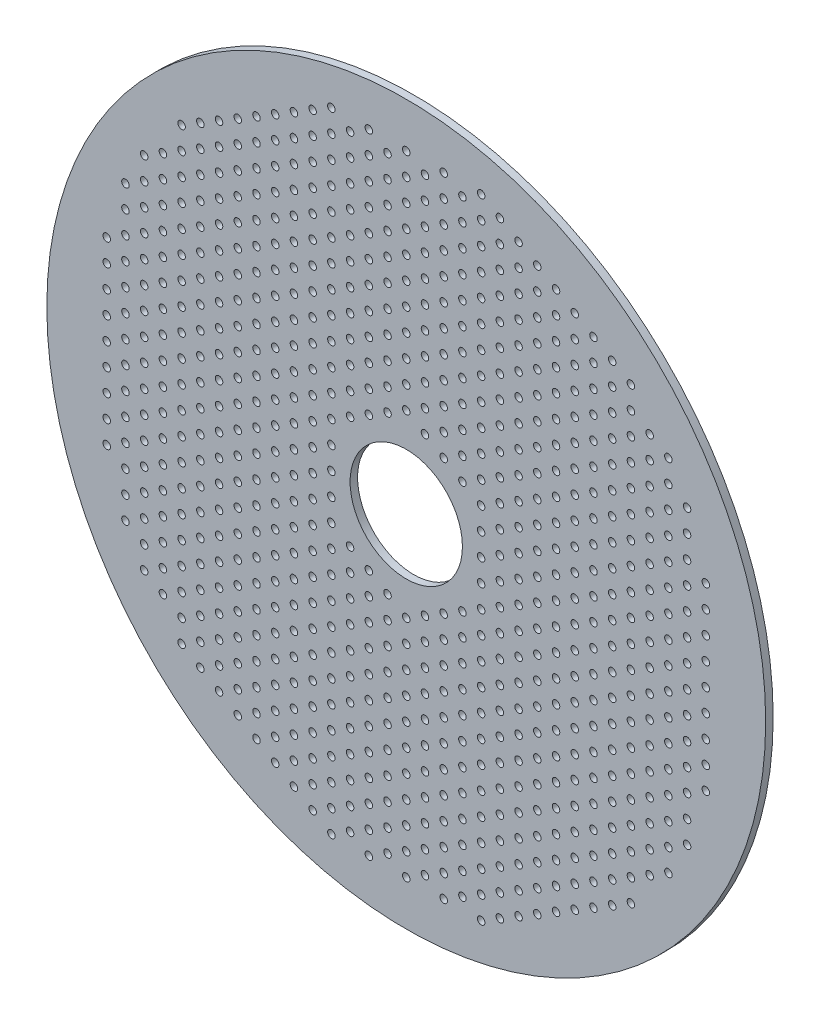
from build123d import *

# Parameters (mm, degrees)
SKETCH_1_R      = 480
SKETCH_1_R_2    = 5
SKETCH_1_R_3    = 75
EXTRUDE_1_DEPTH = 10


with BuildPart() as part:
    # 草图1 → 凸台-拉伸1 (new body)
    with BuildSketch(Plane.XY):
        with Locations((-52.852975542, 0)):
            Circle(SKETCH_1_R)
        with Locations((-152.852975542, 0)):
            Circle(SKETCH_1_R_2, mode=Mode.SUBTRACT)
        with Locations((-202.852975542, 0)):
            Circle(SKETCH_1_R_2, mode=Mode.SUBTRACT)
        with Locations((-252.852975542, 0)):
            Circle(SKETCH_1_R_2, mode=Mode.SUBTRACT)
        with Locations((-302.852975542, 0)):
            Circle(SKETCH_1_R_2, mode=Mode.SUBTRACT)
        with Locations((-352.852975542, 0)):
            Circle(SKETCH_1_R_2, mode=Mode.SUBTRACT)
        with Locations((-402.852975542, 0)):
            Circle(SKETCH_1_R_2, mode=Mode.SUBTRACT)
        with Locations((-452.852975542, 0)):
            Circle(SKETCH_1_R_2, mode=Mode.SUBTRACT)
        with Locations((-452.852975542, -30)):
            Circle(SKETCH_1_R_2, mode=Mode.SUBTRACT)
        with Locations((-452.852975542, -60)):
            Circle(SKETCH_1_R_2, mode=Mode.SUBTRACT)
        with Locations((-452.852975542, -90)):
            Circle(SKETCH_1_R_2, mode=Mode.SUBTRACT)
        with Locations((-452.852975542, -120)):
            Circle(SKETCH_1_R_2, mode=Mode.SUBTRACT)
        with Locations((-402.852975542, -30)):
            Circle(SKETCH_1_R_2, mode=Mode.SUBTRACT)
        with Locations((-402.852975542, -60)):
            Circle(SKETCH_1_R_2, mode=Mode.SUBTRACT)
        with Locations((-402.852975542, -90)):
            Circle(SKETCH_1_R_2, mode=Mode.SUBTRACT)
        with Locations((-402.852975542, -120)):
            Circle(SKETCH_1_R_2, mode=Mode.SUBTRACT)
        with Locations((-402.852975542, -150)):
            Circle(SKETCH_1_R_2, mode=Mode.SUBTRACT)
        with Locations((-402.852975542, -180)):
            Circle(SKETCH_1_R_2, mode=Mode.SUBTRACT)
        with Locations((-402.852975542, -210)):
            Circle(SKETCH_1_R_2, mode=Mode.SUBTRACT)
        with Locations((-402.852975542, -240)):
            Circle(SKETCH_1_R_2, mode=Mode.SUBTRACT)
        with Locations((-352.852975542, -30)):
            Circle(SKETCH_1_R_2, mode=Mode.SUBTRACT)
        with Locations((-352.852975542, -60)):
            Circle(SKETCH_1_R_2, mode=Mode.SUBTRACT)
        with Locations((-352.852975542, -90)):
            Circle(SKETCH_1_R_2, mode=Mode.SUBTRACT)
        with Locations((-352.852975542, -120)):
            Circle(SKETCH_1_R_2, mode=Mode.SUBTRACT)
        with Locations((-352.852975542, -150)):
            Circle(SKETCH_1_R_2, mode=Mode.SUBTRACT)
        with Locations((-352.852975542, -180)):
            Circle(SKETCH_1_R_2, mode=Mode.SUBTRACT)
        with Locations((-352.852975542, -210)):
            Circle(SKETCH_1_R_2, mode=Mode.SUBTRACT)
        with Locations((-352.852975542, -240)):
            Circle(SKETCH_1_R_2, mode=Mode.SUBTRACT)
        with Locations((-352.852975542, -270)):
            Circle(SKETCH_1_R_2, mode=Mode.SUBTRACT)
        with Locations((-352.852975542, -300)):
            Circle(SKETCH_1_R_2, mode=Mode.SUBTRACT)
        with Locations((-302.852975542, -30)):
            Circle(SKETCH_1_R_2, mode=Mode.SUBTRACT)
        with Locations((-302.852975542, -60)):
            Circle(SKETCH_1_R_2, mode=Mode.SUBTRACT)
        with Locations((-302.852975542, -90)):
            Circle(SKETCH_1_R_2, mode=Mode.SUBTRACT)
        with Locations((-302.852975542, -120)):
            Circle(SKETCH_1_R_2, mode=Mode.SUBTRACT)
        with Locations((-302.852975542, -150)):
            Circle(SKETCH_1_R_2, mode=Mode.SUBTRACT)
        with Locations((-302.852975542, -180)):
            Circle(SKETCH_1_R_2, mode=Mode.SUBTRACT)
        with Locations((-302.852975542, -210)):
            Circle(SKETCH_1_R_2, mode=Mode.SUBTRACT)
        with Locations((-302.852975542, -240)):
            Circle(SKETCH_1_R_2, mode=Mode.SUBTRACT)
        with Locations((-302.852975542, -270)):
            Circle(SKETCH_1_R_2, mode=Mode.SUBTRACT)
        with Locations((-302.852975542, -300)):
            Circle(SKETCH_1_R_2, mode=Mode.SUBTRACT)
        with Locations((-302.852975542, -330)):
            Circle(SKETCH_1_R_2, mode=Mode.SUBTRACT)
        with Locations((-252.852975542, -30)):
            Circle(SKETCH_1_R_2, mode=Mode.SUBTRACT)
        with Locations((-252.852975542, -60)):
            Circle(SKETCH_1_R_2, mode=Mode.SUBTRACT)
        with Locations((-252.852975542, -90)):
            Circle(SKETCH_1_R_2, mode=Mode.SUBTRACT)
        with Locations((-252.852975542, -120)):
            Circle(SKETCH_1_R_2, mode=Mode.SUBTRACT)
        with Locations((-252.852975542, -150)):
            Circle(SKETCH_1_R_2, mode=Mode.SUBTRACT)
        with Locations((-252.852975542, -180)):
            Circle(SKETCH_1_R_2, mode=Mode.SUBTRACT)
        with Locations((-252.852975542, -210)):
            Circle(SKETCH_1_R_2, mode=Mode.SUBTRACT)
        with Locations((-252.852975542, -240)):
            Circle(SKETCH_1_R_2, mode=Mode.SUBTRACT)
        with Locations((-252.852975542, -270)):
            Circle(SKETCH_1_R_2, mode=Mode.SUBTRACT)
        with Locations((-252.852975542, -300)):
            Circle(SKETCH_1_R_2, mode=Mode.SUBTRACT)
        with Locations((-252.852975542, -330)):
            Circle(SKETCH_1_R_2, mode=Mode.SUBTRACT)
        with Locations((-252.852975542, -360)):
            Circle(SKETCH_1_R_2, mode=Mode.SUBTRACT)
        with Locations((-202.852975542, -30)):
            Circle(SKETCH_1_R_2, mode=Mode.SUBTRACT)
        with Locations((-202.852975542, -60)):
            Circle(SKETCH_1_R_2, mode=Mode.SUBTRACT)
        with Locations((-202.852975542, -90)):
            Circle(SKETCH_1_R_2, mode=Mode.SUBTRACT)
        with Locations((-202.852975542, -120)):
            Circle(SKETCH_1_R_2, mode=Mode.SUBTRACT)
        with Locations((-202.852975542, -150)):
            Circle(SKETCH_1_R_2, mode=Mode.SUBTRACT)
        with Locations((-202.852975542, -180)):
            Circle(SKETCH_1_R_2, mode=Mode.SUBTRACT)
        with Locations((-202.852975542, -210)):
            Circle(SKETCH_1_R_2, mode=Mode.SUBTRACT)
        with Locations((-202.852975542, -240)):
            Circle(SKETCH_1_R_2, mode=Mode.SUBTRACT)
        with Locations((-202.852975542, -270)):
            Circle(SKETCH_1_R_2, mode=Mode.SUBTRACT)
        with Locations((-202.852975542, -300)):
            Circle(SKETCH_1_R_2, mode=Mode.SUBTRACT)
        with Locations((-202.852975542, -330)):
            Circle(SKETCH_1_R_2, mode=Mode.SUBTRACT)
        with Locations((-202.852975542, -360)):
            Circle(SKETCH_1_R_2, mode=Mode.SUBTRACT)
        with Locations((-202.852975542, -390)):
            Circle(SKETCH_1_R_2, mode=Mode.SUBTRACT)
        with Locations((-152.852975542, -30)):
            Circle(SKETCH_1_R_2, mode=Mode.SUBTRACT)
        with Locations((-152.852975542, -60)):
            Circle(SKETCH_1_R_2, mode=Mode.SUBTRACT)
        with Locations((-152.852975542, -90)):
            Circle(SKETCH_1_R_2, mode=Mode.SUBTRACT)
        with Locations((-152.852975542, -120)):
            Circle(SKETCH_1_R_2, mode=Mode.SUBTRACT)
        with Locations((-152.852975542, -150)):
            Circle(SKETCH_1_R_2, mode=Mode.SUBTRACT)
        with Locations((-152.852975542, -180)):
            Circle(SKETCH_1_R_2, mode=Mode.SUBTRACT)
        with Locations((-152.852975542, -210)):
            Circle(SKETCH_1_R_2, mode=Mode.SUBTRACT)
        with Locations((-152.852975542, -240)):
            Circle(SKETCH_1_R_2, mode=Mode.SUBTRACT)
        with Locations((-152.852975542, -270)):
            Circle(SKETCH_1_R_2, mode=Mode.SUBTRACT)
        with Locations((-152.852975542, -300)):
            Circle(SKETCH_1_R_2, mode=Mode.SUBTRACT)
        with Locations((-152.852975542, -330)):
            Circle(SKETCH_1_R_2, mode=Mode.SUBTRACT)
        with Locations((-152.852975542, -360)):
            Circle(SKETCH_1_R_2, mode=Mode.SUBTRACT)
        with Locations((-152.852975542, -390)):
            Circle(SKETCH_1_R_2, mode=Mode.SUBTRACT)
        with Locations((-152.852975542, -420)):
            Circle(SKETCH_1_R_2, mode=Mode.SUBTRACT)
        with Locations((-427.852975542, -15)):
            Circle(SKETCH_1_R_2, mode=Mode.SUBTRACT)
        with Locations((-377.852975542, -15)):
            Circle(SKETCH_1_R_2, mode=Mode.SUBTRACT)
        with Locations((-327.852975542, -15)):
            Circle(SKETCH_1_R_2, mode=Mode.SUBTRACT)
        with Locations((-277.852975542, -15)):
            Circle(SKETCH_1_R_2, mode=Mode.SUBTRACT)
        with Locations((-227.852975542, -15)):
            Circle(SKETCH_1_R_2, mode=Mode.SUBTRACT)
        with Locations((-177.852975542, -15)):
            Circle(SKETCH_1_R_2, mode=Mode.SUBTRACT)
        with Locations((-377.852975542, -45)):
            Circle(SKETCH_1_R_2, mode=Mode.SUBTRACT)
        with Locations((-327.852975542, -45)):
            Circle(SKETCH_1_R_2, mode=Mode.SUBTRACT)
        with Locations((-277.852975542, -45)):
            Circle(SKETCH_1_R_2, mode=Mode.SUBTRACT)
        with Locations((-227.852975542, -45)):
            Circle(SKETCH_1_R_2, mode=Mode.SUBTRACT)
        with Locations((-177.852975542, -45)):
            Circle(SKETCH_1_R_2, mode=Mode.SUBTRACT)
        with Locations((-377.852975542, -75)):
            Circle(SKETCH_1_R_2, mode=Mode.SUBTRACT)
        with Locations((-327.852975542, -75)):
            Circle(SKETCH_1_R_2, mode=Mode.SUBTRACT)
        with Locations((-277.852975542, -75)):
            Circle(SKETCH_1_R_2, mode=Mode.SUBTRACT)
        with Locations((-227.852975542, -75)):
            Circle(SKETCH_1_R_2, mode=Mode.SUBTRACT)
        with Locations((-177.852975542, -75)):
            Circle(SKETCH_1_R_2, mode=Mode.SUBTRACT)
        with Locations((-377.852975542, -105)):
            Circle(SKETCH_1_R_2, mode=Mode.SUBTRACT)
        with Locations((-327.852975542, -105)):
            Circle(SKETCH_1_R_2, mode=Mode.SUBTRACT)
        with Locations((-277.852975542, -105)):
            Circle(SKETCH_1_R_2, mode=Mode.SUBTRACT)
        with Locations((-227.852975542, -105)):
            Circle(SKETCH_1_R_2, mode=Mode.SUBTRACT)
        with Locations((-177.852975542, -105)):
            Circle(SKETCH_1_R_2, mode=Mode.SUBTRACT)
        with Locations((-377.852975542, -135)):
            Circle(SKETCH_1_R_2, mode=Mode.SUBTRACT)
        with Locations((-327.852975542, -135)):
            Circle(SKETCH_1_R_2, mode=Mode.SUBTRACT)
        with Locations((-277.852975542, -135)):
            Circle(SKETCH_1_R_2, mode=Mode.SUBTRACT)
        with Locations((-227.852975542, -135)):
            Circle(SKETCH_1_R_2, mode=Mode.SUBTRACT)
        with Locations((-177.852975542, -135)):
            Circle(SKETCH_1_R_2, mode=Mode.SUBTRACT)
        with Locations((-377.852975542, -165)):
            Circle(SKETCH_1_R_2, mode=Mode.SUBTRACT)
        with Locations((-327.852975542, -165)):
            Circle(SKETCH_1_R_2, mode=Mode.SUBTRACT)
        with Locations((-277.852975542, -165)):
            Circle(SKETCH_1_R_2, mode=Mode.SUBTRACT)
        with Locations((-227.852975542, -165)):
            Circle(SKETCH_1_R_2, mode=Mode.SUBTRACT)
        with Locations((-177.852975542, -165)):
            Circle(SKETCH_1_R_2, mode=Mode.SUBTRACT)
        with Locations((-377.852975542, -195)):
            Circle(SKETCH_1_R_2, mode=Mode.SUBTRACT)
        with Locations((-327.852975542, -195)):
            Circle(SKETCH_1_R_2, mode=Mode.SUBTRACT)
        with Locations((-277.852975542, -195)):
            Circle(SKETCH_1_R_2, mode=Mode.SUBTRACT)
        with Locations((-227.852975542, -195)):
            Circle(SKETCH_1_R_2, mode=Mode.SUBTRACT)
        with Locations((-177.852975542, -195)):
            Circle(SKETCH_1_R_2, mode=Mode.SUBTRACT)
        with Locations((-377.852975542, -225)):
            Circle(SKETCH_1_R_2, mode=Mode.SUBTRACT)
        with Locations((-327.852975542, -225)):
            Circle(SKETCH_1_R_2, mode=Mode.SUBTRACT)
        with Locations((-277.852975542, -225)):
            Circle(SKETCH_1_R_2, mode=Mode.SUBTRACT)
        with Locations((-227.852975542, -225)):
            Circle(SKETCH_1_R_2, mode=Mode.SUBTRACT)
        with Locations((-177.852975542, -225)):
            Circle(SKETCH_1_R_2, mode=Mode.SUBTRACT)
        with Locations((-377.852975542, -255)):
            Circle(SKETCH_1_R_2, mode=Mode.SUBTRACT)
        with Locations((-327.852975542, -255)):
            Circle(SKETCH_1_R_2, mode=Mode.SUBTRACT)
        with Locations((-277.852975542, -255)):
            Circle(SKETCH_1_R_2, mode=Mode.SUBTRACT)
        with Locations((-227.852975542, -255)):
            Circle(SKETCH_1_R_2, mode=Mode.SUBTRACT)
        with Locations((-177.852975542, -255)):
            Circle(SKETCH_1_R_2, mode=Mode.SUBTRACT)
        with Locations((-327.852975542, -285)):
            Circle(SKETCH_1_R_2, mode=Mode.SUBTRACT)
        with Locations((-277.852975542, -285)):
            Circle(SKETCH_1_R_2, mode=Mode.SUBTRACT)
        with Locations((-227.852975542, -285)):
            Circle(SKETCH_1_R_2, mode=Mode.SUBTRACT)
        with Locations((-177.852975542, -285)):
            Circle(SKETCH_1_R_2, mode=Mode.SUBTRACT)
        with Locations((-327.852975542, -315)):
            Circle(SKETCH_1_R_2, mode=Mode.SUBTRACT)
        with Locations((-277.852975542, -315)):
            Circle(SKETCH_1_R_2, mode=Mode.SUBTRACT)
        with Locations((-227.852975542, -315)):
            Circle(SKETCH_1_R_2, mode=Mode.SUBTRACT)
        with Locations((-177.852975542, -315)):
            Circle(SKETCH_1_R_2, mode=Mode.SUBTRACT)
        with Locations((-277.852975542, -345)):
            Circle(SKETCH_1_R_2, mode=Mode.SUBTRACT)
        with Locations((-227.852975542, -345)):
            Circle(SKETCH_1_R_2, mode=Mode.SUBTRACT)
        with Locations((-177.852975542, -345)):
            Circle(SKETCH_1_R_2, mode=Mode.SUBTRACT)
        with Locations((-227.852975542, -375)):
            Circle(SKETCH_1_R_2, mode=Mode.SUBTRACT)
        with Locations((-177.852975542, -375)):
            Circle(SKETCH_1_R_2, mode=Mode.SUBTRACT)
        with Locations((-177.852975542, -405)):
            Circle(SKETCH_1_R_2, mode=Mode.SUBTRACT)
        with Locations((-427.852975542, -45)):
            Circle(SKETCH_1_R_2, mode=Mode.SUBTRACT)
        with Locations((-427.852975542, -75)):
            Circle(SKETCH_1_R_2, mode=Mode.SUBTRACT)
        with Locations((-427.852975542, -105)):
            Circle(SKETCH_1_R_2, mode=Mode.SUBTRACT)
        with Locations((-427.852975542, -135)):
            Circle(SKETCH_1_R_2, mode=Mode.SUBTRACT)
        with Locations((-427.852975542, -165)):
            Circle(SKETCH_1_R_2, mode=Mode.SUBTRACT)
        with Locations((-427.852975542, -195)):
            Circle(SKETCH_1_R_2, mode=Mode.SUBTRACT)
        with Locations((-77.852975542, -105)):
            Circle(SKETCH_1_R_2, mode=Mode.SUBTRACT)
        with Locations((-77.852975542, -135)):
            Circle(SKETCH_1_R_2, mode=Mode.SUBTRACT)
        with Locations((-52.852975542, -120)):
            Circle(SKETCH_1_R_2, mode=Mode.SUBTRACT)
        with Locations((-77.852975542, -165)):
            Circle(SKETCH_1_R_2, mode=Mode.SUBTRACT)
        with Locations((-52.852975542, -150)):
            Circle(SKETCH_1_R_2, mode=Mode.SUBTRACT)
        with Locations((-77.852975542, -195)):
            Circle(SKETCH_1_R_2, mode=Mode.SUBTRACT)
        with Locations((-52.852975542, -180)):
            Circle(SKETCH_1_R_2, mode=Mode.SUBTRACT)
        with Locations((-77.852975542, -225)):
            Circle(SKETCH_1_R_2, mode=Mode.SUBTRACT)
        with Locations((-52.852975542, -210)):
            Circle(SKETCH_1_R_2, mode=Mode.SUBTRACT)
        with Locations((-77.852975542, -255)):
            Circle(SKETCH_1_R_2, mode=Mode.SUBTRACT)
        with Locations((-52.852975542, -240)):
            Circle(SKETCH_1_R_2, mode=Mode.SUBTRACT)
        with Locations((-77.852975542, -285)):
            Circle(SKETCH_1_R_2, mode=Mode.SUBTRACT)
        with Locations((-52.852975542, -270)):
            Circle(SKETCH_1_R_2, mode=Mode.SUBTRACT)
        with Locations((-77.852975542, -315)):
            Circle(SKETCH_1_R_2, mode=Mode.SUBTRACT)
        with Locations((-52.852975542, -300)):
            Circle(SKETCH_1_R_2, mode=Mode.SUBTRACT)
        with Locations((-77.852975542, -345)):
            Circle(SKETCH_1_R_2, mode=Mode.SUBTRACT)
        with Locations((-52.852975542, -330)):
            Circle(SKETCH_1_R_2, mode=Mode.SUBTRACT)
        with Locations((-77.852975542, -375)):
            Circle(SKETCH_1_R_2, mode=Mode.SUBTRACT)
        with Locations((-52.852975542, -360)):
            Circle(SKETCH_1_R_2, mode=Mode.SUBTRACT)
        with Locations((-77.852975542, -405)):
            Circle(SKETCH_1_R_2, mode=Mode.SUBTRACT)
        with Locations((-52.852975542, -390)):
            Circle(SKETCH_1_R_2, mode=Mode.SUBTRACT)
        with Locations((-52.852975542, -420)):
            Circle(SKETCH_1_R_2, mode=Mode.SUBTRACT)
        with Locations((-127.852975542, -75)):
            Circle(SKETCH_1_R_2, mode=Mode.SUBTRACT)
        with Locations((-127.852975542, -105)):
            Circle(SKETCH_1_R_2, mode=Mode.SUBTRACT)
        with Locations((-102.852975542, -90)):
            Circle(SKETCH_1_R_2, mode=Mode.SUBTRACT)
        with Locations((-127.852975542, -135)):
            Circle(SKETCH_1_R_2, mode=Mode.SUBTRACT)
        with Locations((-102.852975542, -120)):
            Circle(SKETCH_1_R_2, mode=Mode.SUBTRACT)
        with Locations((-127.852975542, -165)):
            Circle(SKETCH_1_R_2, mode=Mode.SUBTRACT)
        with Locations((-102.852975542, -150)):
            Circle(SKETCH_1_R_2, mode=Mode.SUBTRACT)
        with Locations((-127.852975542, -195)):
            Circle(SKETCH_1_R_2, mode=Mode.SUBTRACT)
        with Locations((-102.852975542, -180)):
            Circle(SKETCH_1_R_2, mode=Mode.SUBTRACT)
        with Locations((-127.852975542, -225)):
            Circle(SKETCH_1_R_2, mode=Mode.SUBTRACT)
        with Locations((-102.852975542, -210)):
            Circle(SKETCH_1_R_2, mode=Mode.SUBTRACT)
        with Locations((-127.852975542, -255)):
            Circle(SKETCH_1_R_2, mode=Mode.SUBTRACT)
        with Locations((-102.852975542, -240)):
            Circle(SKETCH_1_R_2, mode=Mode.SUBTRACT)
        with Locations((-127.852975542, -285)):
            Circle(SKETCH_1_R_2, mode=Mode.SUBTRACT)
        with Locations((-102.852975542, -270)):
            Circle(SKETCH_1_R_2, mode=Mode.SUBTRACT)
        with Locations((-127.852975542, -315)):
            Circle(SKETCH_1_R_2, mode=Mode.SUBTRACT)
        with Locations((-102.852975542, -300)):
            Circle(SKETCH_1_R_2, mode=Mode.SUBTRACT)
        with Locations((-127.852975542, -345)):
            Circle(SKETCH_1_R_2, mode=Mode.SUBTRACT)
        with Locations((-102.852975542, -330)):
            Circle(SKETCH_1_R_2, mode=Mode.SUBTRACT)
        with Locations((-127.852975542, -375)):
            Circle(SKETCH_1_R_2, mode=Mode.SUBTRACT)
        with Locations((-102.852975542, -360)):
            Circle(SKETCH_1_R_2, mode=Mode.SUBTRACT)
        with Locations((-127.852975542, -405)):
            Circle(SKETCH_1_R_2, mode=Mode.SUBTRACT)
        with Locations((-102.852975542, -390)):
            Circle(SKETCH_1_R_2, mode=Mode.SUBTRACT)
        with Locations((-102.852975542, -420)):
            Circle(SKETCH_1_R_2, mode=Mode.SUBTRACT)
        with Locations((-52.852975542, 0)):
            Circle(SKETCH_1_R_3, mode=Mode.SUBTRACT)
        with Locations(Location((-2.852975542, -420, 0), (0, 0, 180))):
            Circle(SKETCH_1_R_2, mode=Mode.SUBTRACT)
        with Locations(Location((-2.852975542, -390, 0), (0, 0, 180))):
            Circle(SKETCH_1_R_2, mode=Mode.SUBTRACT)
        with Locations(Location((22.147024458, -405, 0), (0, 0, 180))):
            Circle(SKETCH_1_R_2, mode=Mode.SUBTRACT)
        with Locations(Location((-2.852975542, -360, 0), (0, 0, 180))):
            Circle(SKETCH_1_R_2, mode=Mode.SUBTRACT)
        with Locations(Location((22.147024458, -375, 0), (0, 0, 180))):
            Circle(SKETCH_1_R_2, mode=Mode.SUBTRACT)
        with Locations(Location((-2.852975542, -330, 0), (0, 0, 180))):
            Circle(SKETCH_1_R_2, mode=Mode.SUBTRACT)
        with Locations(Location((22.147024458, -345, 0), (0, 0, 180))):
            Circle(SKETCH_1_R_2, mode=Mode.SUBTRACT)
        with Locations(Location((-2.852975542, -300, 0), (0, 0, 180))):
            Circle(SKETCH_1_R_2, mode=Mode.SUBTRACT)
        with Locations(Location((22.147024458, -315, 0), (0, 0, 180))):
            Circle(SKETCH_1_R_2, mode=Mode.SUBTRACT)
        with Locations(Location((-2.852975542, -270, 0), (0, 0, 180))):
            Circle(SKETCH_1_R_2, mode=Mode.SUBTRACT)
        with Locations(Location((22.147024458, -285, 0), (0, 0, 180))):
            Circle(SKETCH_1_R_2, mode=Mode.SUBTRACT)
        with Locations(Location((-2.852975542, -240, 0), (0, 0, 180))):
            Circle(SKETCH_1_R_2, mode=Mode.SUBTRACT)
        with Locations(Location((22.147024458, -255, 0), (0, 0, 180))):
            Circle(SKETCH_1_R_2, mode=Mode.SUBTRACT)
        with Locations(Location((-2.852975542, -210, 0), (0, 0, 180))):
            Circle(SKETCH_1_R_2, mode=Mode.SUBTRACT)
        with Locations(Location((22.147024458, -225, 0), (0, 0, 180))):
            Circle(SKETCH_1_R_2, mode=Mode.SUBTRACT)
        with Locations(Location((-2.852975542, -180, 0), (0, 0, 180))):
            Circle(SKETCH_1_R_2, mode=Mode.SUBTRACT)
        with Locations(Location((22.147024458, -195, 0), (0, 0, 180))):
            Circle(SKETCH_1_R_2, mode=Mode.SUBTRACT)
        with Locations(Location((-2.852975542, -150, 0), (0, 0, 180))):
            Circle(SKETCH_1_R_2, mode=Mode.SUBTRACT)
        with Locations(Location((22.147024458, -165, 0), (0, 0, 180))):
            Circle(SKETCH_1_R_2, mode=Mode.SUBTRACT)
        with Locations(Location((-2.852975542, -120, 0), (0, 0, 180))):
            Circle(SKETCH_1_R_2, mode=Mode.SUBTRACT)
        with Locations(Location((22.147024458, -135, 0), (0, 0, 180))):
            Circle(SKETCH_1_R_2, mode=Mode.SUBTRACT)
        with Locations(Location((-2.852975542, -90, 0), (0, 0, 180))):
            Circle(SKETCH_1_R_2, mode=Mode.SUBTRACT)
        with Locations(Location((22.147024458, -105, 0), (0, 0, 180))):
            Circle(SKETCH_1_R_2, mode=Mode.SUBTRACT)
        with Locations(Location((22.147024458, -75, 0), (0, 0, 180))):
            Circle(SKETCH_1_R_2, mode=Mode.SUBTRACT)
        with Locations(Location((-27.852975542, -405, 0), (0, 0, 180))):
            Circle(SKETCH_1_R_2, mode=Mode.SUBTRACT)
        with Locations(Location((-27.852975542, -375, 0), (0, 0, 180))):
            Circle(SKETCH_1_R_2, mode=Mode.SUBTRACT)
        with Locations(Location((-27.852975542, -345, 0), (0, 0, 180))):
            Circle(SKETCH_1_R_2, mode=Mode.SUBTRACT)
        with Locations(Location((-27.852975542, -315, 0), (0, 0, 180))):
            Circle(SKETCH_1_R_2, mode=Mode.SUBTRACT)
        with Locations(Location((-27.852975542, -285, 0), (0, 0, 180))):
            Circle(SKETCH_1_R_2, mode=Mode.SUBTRACT)
        with Locations(Location((-27.852975542, -255, 0), (0, 0, 180))):
            Circle(SKETCH_1_R_2, mode=Mode.SUBTRACT)
        with Locations(Location((-27.852975542, -225, 0), (0, 0, 180))):
            Circle(SKETCH_1_R_2, mode=Mode.SUBTRACT)
        with Locations(Location((-27.852975542, -195, 0), (0, 0, 180))):
            Circle(SKETCH_1_R_2, mode=Mode.SUBTRACT)
        with Locations(Location((-27.852975542, -165, 0), (0, 0, 180))):
            Circle(SKETCH_1_R_2, mode=Mode.SUBTRACT)
        with Locations(Location((-27.852975542, -135, 0), (0, 0, 180))):
            Circle(SKETCH_1_R_2, mode=Mode.SUBTRACT)
        with Locations(Location((-27.852975542, -105, 0), (0, 0, 180))):
            Circle(SKETCH_1_R_2, mode=Mode.SUBTRACT)
        with Locations(Location((322.147024458, -195, 0), (0, 0, 180))):
            Circle(SKETCH_1_R_2, mode=Mode.SUBTRACT)
        with Locations(Location((322.147024458, -165, 0), (0, 0, 180))):
            Circle(SKETCH_1_R_2, mode=Mode.SUBTRACT)
        with Locations(Location((322.147024458, -135, 0), (0, 0, 180))):
            Circle(SKETCH_1_R_2, mode=Mode.SUBTRACT)
        with Locations(Location((322.147024458, -105, 0), (0, 0, 180))):
            Circle(SKETCH_1_R_2, mode=Mode.SUBTRACT)
        with Locations(Location((322.147024458, -75, 0), (0, 0, 180))):
            Circle(SKETCH_1_R_2, mode=Mode.SUBTRACT)
        with Locations(Location((322.147024458, -45, 0), (0, 0, 180))):
            Circle(SKETCH_1_R_2, mode=Mode.SUBTRACT)
        with Locations(Location((72.147024458, -405, 0), (0, 0, 180))):
            Circle(SKETCH_1_R_2, mode=Mode.SUBTRACT)
        with Locations(Location((72.147024458, -375, 0), (0, 0, 180))):
            Circle(SKETCH_1_R_2, mode=Mode.SUBTRACT)
        with Locations(Location((122.147024458, -375, 0), (0, 0, 180))):
            Circle(SKETCH_1_R_2, mode=Mode.SUBTRACT)
        with Locations(Location((72.147024458, -345, 0), (0, 0, 180))):
            Circle(SKETCH_1_R_2, mode=Mode.SUBTRACT)
        with Locations(Location((122.147024458, -345, 0), (0, 0, 180))):
            Circle(SKETCH_1_R_2, mode=Mode.SUBTRACT)
        with Locations(Location((172.147024458, -345, 0), (0, 0, 180))):
            Circle(SKETCH_1_R_2, mode=Mode.SUBTRACT)
        with Locations(Location((72.147024458, -315, 0), (0, 0, 180))):
            Circle(SKETCH_1_R_2, mode=Mode.SUBTRACT)
        with Locations(Location((122.147024458, -315, 0), (0, 0, 180))):
            Circle(SKETCH_1_R_2, mode=Mode.SUBTRACT)
        with Locations(Location((172.147024458, -315, 0), (0, 0, 180))):
            Circle(SKETCH_1_R_2, mode=Mode.SUBTRACT)
        with Locations(Location((222.147024458, -315, 0), (0, 0, 180))):
            Circle(SKETCH_1_R_2, mode=Mode.SUBTRACT)
        with Locations(Location((72.147024458, -285, 0), (0, 0, 180))):
            Circle(SKETCH_1_R_2, mode=Mode.SUBTRACT)
        with Locations(Location((122.147024458, -285, 0), (0, 0, 180))):
            Circle(SKETCH_1_R_2, mode=Mode.SUBTRACT)
        with Locations(Location((172.147024458, -285, 0), (0, 0, 180))):
            Circle(SKETCH_1_R_2, mode=Mode.SUBTRACT)
        with Locations(Location((222.147024458, -285, 0), (0, 0, 180))):
            Circle(SKETCH_1_R_2, mode=Mode.SUBTRACT)
        with Locations(Location((72.147024458, -255, 0), (0, 0, 180))):
            Circle(SKETCH_1_R_2, mode=Mode.SUBTRACT)
        with Locations(Location((122.147024458, -255, 0), (0, 0, 180))):
            Circle(SKETCH_1_R_2, mode=Mode.SUBTRACT)
        with Locations(Location((172.147024458, -255, 0), (0, 0, 180))):
            Circle(SKETCH_1_R_2, mode=Mode.SUBTRACT)
        with Locations(Location((222.147024458, -255, 0), (0, 0, 180))):
            Circle(SKETCH_1_R_2, mode=Mode.SUBTRACT)
        with Locations(Location((272.147024458, -255, 0), (0, 0, 180))):
            Circle(SKETCH_1_R_2, mode=Mode.SUBTRACT)
        with Locations(Location((72.147024458, -225, 0), (0, 0, 180))):
            Circle(SKETCH_1_R_2, mode=Mode.SUBTRACT)
        with Locations(Location((122.147024458, -225, 0), (0, 0, 180))):
            Circle(SKETCH_1_R_2, mode=Mode.SUBTRACT)
        with Locations(Location((172.147024458, -225, 0), (0, 0, 180))):
            Circle(SKETCH_1_R_2, mode=Mode.SUBTRACT)
        with Locations(Location((222.147024458, -225, 0), (0, 0, 180))):
            Circle(SKETCH_1_R_2, mode=Mode.SUBTRACT)
        with Locations(Location((272.147024458, -225, 0), (0, 0, 180))):
            Circle(SKETCH_1_R_2, mode=Mode.SUBTRACT)
        with Locations(Location((72.147024458, -195, 0), (0, 0, 180))):
            Circle(SKETCH_1_R_2, mode=Mode.SUBTRACT)
        with Locations(Location((122.147024458, -195, 0), (0, 0, 180))):
            Circle(SKETCH_1_R_2, mode=Mode.SUBTRACT)
        with Locations(Location((172.147024458, -195, 0), (0, 0, 180))):
            Circle(SKETCH_1_R_2, mode=Mode.SUBTRACT)
        with Locations(Location((222.147024458, -195, 0), (0, 0, 180))):
            Circle(SKETCH_1_R_2, mode=Mode.SUBTRACT)
        with Locations(Location((272.147024458, -195, 0), (0, 0, 180))):
            Circle(SKETCH_1_R_2, mode=Mode.SUBTRACT)
        with Locations(Location((72.147024458, -165, 0), (0, 0, 180))):
            Circle(SKETCH_1_R_2, mode=Mode.SUBTRACT)
        with Locations(Location((122.147024458, -165, 0), (0, 0, 180))):
            Circle(SKETCH_1_R_2, mode=Mode.SUBTRACT)
        with Locations(Location((172.147024458, -165, 0), (0, 0, 180))):
            Circle(SKETCH_1_R_2, mode=Mode.SUBTRACT)
        with Locations(Location((222.147024458, -165, 0), (0, 0, 180))):
            Circle(SKETCH_1_R_2, mode=Mode.SUBTRACT)
        with Locations(Location((272.147024458, -165, 0), (0, 0, 180))):
            Circle(SKETCH_1_R_2, mode=Mode.SUBTRACT)
        with Locations(Location((72.147024458, -135, 0), (0, 0, 180))):
            Circle(SKETCH_1_R_2, mode=Mode.SUBTRACT)
        with Locations(Location((122.147024458, -135, 0), (0, 0, 180))):
            Circle(SKETCH_1_R_2, mode=Mode.SUBTRACT)
        with Locations(Location((172.147024458, -135, 0), (0, 0, 180))):
            Circle(SKETCH_1_R_2, mode=Mode.SUBTRACT)
        with Locations(Location((222.147024458, -135, 0), (0, 0, 180))):
            Circle(SKETCH_1_R_2, mode=Mode.SUBTRACT)
        with Locations(Location((272.147024458, -135, 0), (0, 0, 180))):
            Circle(SKETCH_1_R_2, mode=Mode.SUBTRACT)
        with Locations(Location((72.147024458, -105, 0), (0, 0, 180))):
            Circle(SKETCH_1_R_2, mode=Mode.SUBTRACT)
        with Locations(Location((122.147024458, -105, 0), (0, 0, 180))):
            Circle(SKETCH_1_R_2, mode=Mode.SUBTRACT)
        with Locations(Location((172.147024458, -105, 0), (0, 0, 180))):
            Circle(SKETCH_1_R_2, mode=Mode.SUBTRACT)
        with Locations(Location((222.147024458, -105, 0), (0, 0, 180))):
            Circle(SKETCH_1_R_2, mode=Mode.SUBTRACT)
        with Locations(Location((272.147024458, -105, 0), (0, 0, 180))):
            Circle(SKETCH_1_R_2, mode=Mode.SUBTRACT)
        with Locations(Location((72.147024458, -75, 0), (0, 0, 180))):
            Circle(SKETCH_1_R_2, mode=Mode.SUBTRACT)
        with Locations(Location((122.147024458, -75, 0), (0, 0, 180))):
            Circle(SKETCH_1_R_2, mode=Mode.SUBTRACT)
        with Locations(Location((172.147024458, -75, 0), (0, 0, 180))):
            Circle(SKETCH_1_R_2, mode=Mode.SUBTRACT)
        with Locations(Location((222.147024458, -75, 0), (0, 0, 180))):
            Circle(SKETCH_1_R_2, mode=Mode.SUBTRACT)
        with Locations(Location((272.147024458, -75, 0), (0, 0, 180))):
            Circle(SKETCH_1_R_2, mode=Mode.SUBTRACT)
        with Locations(Location((72.147024458, -45, 0), (0, 0, 180))):
            Circle(SKETCH_1_R_2, mode=Mode.SUBTRACT)
        with Locations(Location((122.147024458, -45, 0), (0, 0, 180))):
            Circle(SKETCH_1_R_2, mode=Mode.SUBTRACT)
        with Locations(Location((172.147024458, -45, 0), (0, 0, 180))):
            Circle(SKETCH_1_R_2, mode=Mode.SUBTRACT)
        with Locations(Location((222.147024458, -45, 0), (0, 0, 180))):
            Circle(SKETCH_1_R_2, mode=Mode.SUBTRACT)
        with Locations(Location((272.147024458, -45, 0), (0, 0, 180))):
            Circle(SKETCH_1_R_2, mode=Mode.SUBTRACT)
        with Locations(Location((72.147024458, -15, 0), (0, 0, 180))):
            Circle(SKETCH_1_R_2, mode=Mode.SUBTRACT)
        with Locations(Location((122.147024458, -15, 0), (0, 0, 180))):
            Circle(SKETCH_1_R_2, mode=Mode.SUBTRACT)
        with Locations(Location((172.147024458, -15, 0), (0, 0, 180))):
            Circle(SKETCH_1_R_2, mode=Mode.SUBTRACT)
        with Locations(Location((222.147024458, -15, 0), (0, 0, 180))):
            Circle(SKETCH_1_R_2, mode=Mode.SUBTRACT)
        with Locations(Location((272.147024458, -15, 0), (0, 0, 180))):
            Circle(SKETCH_1_R_2, mode=Mode.SUBTRACT)
        with Locations(Location((322.147024458, -15, 0), (0, 0, 180))):
            Circle(SKETCH_1_R_2, mode=Mode.SUBTRACT)
        with Locations(Location((47.147024458, -420, 0), (0, 0, 180))):
            Circle(SKETCH_1_R_2, mode=Mode.SUBTRACT)
        with Locations(Location((47.147024458, -390, 0), (0, 0, 180))):
            Circle(SKETCH_1_R_2, mode=Mode.SUBTRACT)
        with Locations(Location((47.147024458, -360, 0), (0, 0, 180))):
            Circle(SKETCH_1_R_2, mode=Mode.SUBTRACT)
        with Locations(Location((47.147024458, -330, 0), (0, 0, 180))):
            Circle(SKETCH_1_R_2, mode=Mode.SUBTRACT)
        with Locations(Location((47.147024458, -300, 0), (0, 0, 180))):
            Circle(SKETCH_1_R_2, mode=Mode.SUBTRACT)
        with Locations(Location((47.147024458, -270, 0), (0, 0, 180))):
            Circle(SKETCH_1_R_2, mode=Mode.SUBTRACT)
        with Locations(Location((47.147024458, -240, 0), (0, 0, 180))):
            Circle(SKETCH_1_R_2, mode=Mode.SUBTRACT)
        with Locations(Location((47.147024458, -210, 0), (0, 0, 180))):
            Circle(SKETCH_1_R_2, mode=Mode.SUBTRACT)
        with Locations(Location((47.147024458, -180, 0), (0, 0, 180))):
            Circle(SKETCH_1_R_2, mode=Mode.SUBTRACT)
        with Locations(Location((47.147024458, -150, 0), (0, 0, 180))):
            Circle(SKETCH_1_R_2, mode=Mode.SUBTRACT)
        with Locations(Location((47.147024458, -120, 0), (0, 0, 180))):
            Circle(SKETCH_1_R_2, mode=Mode.SUBTRACT)
        with Locations(Location((47.147024458, -90, 0), (0, 0, 180))):
            Circle(SKETCH_1_R_2, mode=Mode.SUBTRACT)
        with Locations(Location((47.147024458, -60, 0), (0, 0, 180))):
            Circle(SKETCH_1_R_2, mode=Mode.SUBTRACT)
        with Locations(Location((47.147024458, -30, 0), (0, 0, 180))):
            Circle(SKETCH_1_R_2, mode=Mode.SUBTRACT)
        with Locations(Location((97.147024458, -390, 0), (0, 0, 180))):
            Circle(SKETCH_1_R_2, mode=Mode.SUBTRACT)
        with Locations(Location((97.147024458, -360, 0), (0, 0, 180))):
            Circle(SKETCH_1_R_2, mode=Mode.SUBTRACT)
        with Locations(Location((97.147024458, -330, 0), (0, 0, 180))):
            Circle(SKETCH_1_R_2, mode=Mode.SUBTRACT)
        with Locations(Location((97.147024458, -300, 0), (0, 0, 180))):
            Circle(SKETCH_1_R_2, mode=Mode.SUBTRACT)
        with Locations(Location((97.147024458, -270, 0), (0, 0, 180))):
            Circle(SKETCH_1_R_2, mode=Mode.SUBTRACT)
        with Locations(Location((97.147024458, -240, 0), (0, 0, 180))):
            Circle(SKETCH_1_R_2, mode=Mode.SUBTRACT)
        with Locations(Location((97.147024458, -210, 0), (0, 0, 180))):
            Circle(SKETCH_1_R_2, mode=Mode.SUBTRACT)
        with Locations(Location((97.147024458, -180, 0), (0, 0, 180))):
            Circle(SKETCH_1_R_2, mode=Mode.SUBTRACT)
        with Locations(Location((97.147024458, -150, 0), (0, 0, 180))):
            Circle(SKETCH_1_R_2, mode=Mode.SUBTRACT)
        with Locations(Location((97.147024458, -120, 0), (0, 0, 180))):
            Circle(SKETCH_1_R_2, mode=Mode.SUBTRACT)
        with Locations(Location((97.147024458, -90, 0), (0, 0, 180))):
            Circle(SKETCH_1_R_2, mode=Mode.SUBTRACT)
        with Locations(Location((97.147024458, -60, 0), (0, 0, 180))):
            Circle(SKETCH_1_R_2, mode=Mode.SUBTRACT)
        with Locations(Location((97.147024458, -30, 0), (0, 0, 180))):
            Circle(SKETCH_1_R_2, mode=Mode.SUBTRACT)
        with Locations(Location((147.147024458, -360, 0), (0, 0, 180))):
            Circle(SKETCH_1_R_2, mode=Mode.SUBTRACT)
        with Locations(Location((147.147024458, -330, 0), (0, 0, 180))):
            Circle(SKETCH_1_R_2, mode=Mode.SUBTRACT)
        with Locations(Location((147.147024458, -300, 0), (0, 0, 180))):
            Circle(SKETCH_1_R_2, mode=Mode.SUBTRACT)
        with Locations(Location((147.147024458, -270, 0), (0, 0, 180))):
            Circle(SKETCH_1_R_2, mode=Mode.SUBTRACT)
        with Locations(Location((147.147024458, -240, 0), (0, 0, 180))):
            Circle(SKETCH_1_R_2, mode=Mode.SUBTRACT)
        with Locations(Location((147.147024458, -210, 0), (0, 0, 180))):
            Circle(SKETCH_1_R_2, mode=Mode.SUBTRACT)
        with Locations(Location((147.147024458, -180, 0), (0, 0, 180))):
            Circle(SKETCH_1_R_2, mode=Mode.SUBTRACT)
        with Locations(Location((147.147024458, -150, 0), (0, 0, 180))):
            Circle(SKETCH_1_R_2, mode=Mode.SUBTRACT)
        with Locations(Location((147.147024458, -120, 0), (0, 0, 180))):
            Circle(SKETCH_1_R_2, mode=Mode.SUBTRACT)
        with Locations(Location((147.147024458, -90, 0), (0, 0, 180))):
            Circle(SKETCH_1_R_2, mode=Mode.SUBTRACT)
        with Locations(Location((147.147024458, -60, 0), (0, 0, 180))):
            Circle(SKETCH_1_R_2, mode=Mode.SUBTRACT)
        with Locations(Location((147.147024458, -30, 0), (0, 0, 180))):
            Circle(SKETCH_1_R_2, mode=Mode.SUBTRACT)
        with Locations(Location((197.147024458, -330, 0), (0, 0, 180))):
            Circle(SKETCH_1_R_2, mode=Mode.SUBTRACT)
        with Locations(Location((197.147024458, -300, 0), (0, 0, 180))):
            Circle(SKETCH_1_R_2, mode=Mode.SUBTRACT)
        with Locations(Location((197.147024458, -270, 0), (0, 0, 180))):
            Circle(SKETCH_1_R_2, mode=Mode.SUBTRACT)
        with Locations(Location((197.147024458, -240, 0), (0, 0, 180))):
            Circle(SKETCH_1_R_2, mode=Mode.SUBTRACT)
        with Locations(Location((197.147024458, -210, 0), (0, 0, 180))):
            Circle(SKETCH_1_R_2, mode=Mode.SUBTRACT)
        with Locations(Location((197.147024458, -180, 0), (0, 0, 180))):
            Circle(SKETCH_1_R_2, mode=Mode.SUBTRACT)
        with Locations(Location((197.147024458, -150, 0), (0, 0, 180))):
            Circle(SKETCH_1_R_2, mode=Mode.SUBTRACT)
        with Locations(Location((197.147024458, -120, 0), (0, 0, 180))):
            Circle(SKETCH_1_R_2, mode=Mode.SUBTRACT)
        with Locations(Location((197.147024458, -90, 0), (0, 0, 180))):
            Circle(SKETCH_1_R_2, mode=Mode.SUBTRACT)
        with Locations(Location((197.147024458, -60, 0), (0, 0, 180))):
            Circle(SKETCH_1_R_2, mode=Mode.SUBTRACT)
        with Locations(Location((197.147024458, -30, 0), (0, 0, 180))):
            Circle(SKETCH_1_R_2, mode=Mode.SUBTRACT)
        with Locations(Location((247.147024458, -300, 0), (0, 0, 180))):
            Circle(SKETCH_1_R_2, mode=Mode.SUBTRACT)
        with Locations(Location((247.147024458, -270, 0), (0, 0, 180))):
            Circle(SKETCH_1_R_2, mode=Mode.SUBTRACT)
        with Locations(Location((247.147024458, -240, 0), (0, 0, 180))):
            Circle(SKETCH_1_R_2, mode=Mode.SUBTRACT)
        with Locations(Location((247.147024458, -210, 0), (0, 0, 180))):
            Circle(SKETCH_1_R_2, mode=Mode.SUBTRACT)
        with Locations(Location((247.147024458, -180, 0), (0, 0, 180))):
            Circle(SKETCH_1_R_2, mode=Mode.SUBTRACT)
        with Locations(Location((247.147024458, -150, 0), (0, 0, 180))):
            Circle(SKETCH_1_R_2, mode=Mode.SUBTRACT)
        with Locations(Location((247.147024458, -120, 0), (0, 0, 180))):
            Circle(SKETCH_1_R_2, mode=Mode.SUBTRACT)
        with Locations(Location((247.147024458, -90, 0), (0, 0, 180))):
            Circle(SKETCH_1_R_2, mode=Mode.SUBTRACT)
        with Locations(Location((247.147024458, -60, 0), (0, 0, 180))):
            Circle(SKETCH_1_R_2, mode=Mode.SUBTRACT)
        with Locations(Location((247.147024458, -30, 0), (0, 0, 180))):
            Circle(SKETCH_1_R_2, mode=Mode.SUBTRACT)
        with Locations(Location((297.147024458, -240, 0), (0, 0, 180))):
            Circle(SKETCH_1_R_2, mode=Mode.SUBTRACT)
        with Locations(Location((297.147024458, -210, 0), (0, 0, 180))):
            Circle(SKETCH_1_R_2, mode=Mode.SUBTRACT)
        with Locations(Location((297.147024458, -180, 0), (0, 0, 180))):
            Circle(SKETCH_1_R_2, mode=Mode.SUBTRACT)
        with Locations(Location((297.147024458, -150, 0), (0, 0, 180))):
            Circle(SKETCH_1_R_2, mode=Mode.SUBTRACT)
        with Locations(Location((297.147024458, -120, 0), (0, 0, 180))):
            Circle(SKETCH_1_R_2, mode=Mode.SUBTRACT)
        with Locations(Location((297.147024458, -90, 0), (0, 0, 180))):
            Circle(SKETCH_1_R_2, mode=Mode.SUBTRACT)
        with Locations(Location((297.147024458, -60, 0), (0, 0, 180))):
            Circle(SKETCH_1_R_2, mode=Mode.SUBTRACT)
        with Locations(Location((297.147024458, -30, 0), (0, 0, 180))):
            Circle(SKETCH_1_R_2, mode=Mode.SUBTRACT)
        with Locations(Location((347.147024458, -120, 0), (0, 0, 180))):
            Circle(SKETCH_1_R_2, mode=Mode.SUBTRACT)
        with Locations(Location((347.147024458, -90, 0), (0, 0, 180))):
            Circle(SKETCH_1_R_2, mode=Mode.SUBTRACT)
        with Locations(Location((347.147024458, -60, 0), (0, 0, 180))):
            Circle(SKETCH_1_R_2, mode=Mode.SUBTRACT)
        with Locations(Location((347.147024458, -30, 0), (0, 0, 180))):
            Circle(SKETCH_1_R_2, mode=Mode.SUBTRACT)
        with Locations(Location((347.147024458, 0, 0), (0, 0, 180))):
            Circle(SKETCH_1_R_2, mode=Mode.SUBTRACT)
        with Locations(Location((297.147024458, 0, 0), (0, 0, 180))):
            Circle(SKETCH_1_R_2, mode=Mode.SUBTRACT)
        with Locations(Location((247.147024458, 0, 0), (0, 0, 180))):
            Circle(SKETCH_1_R_2, mode=Mode.SUBTRACT)
        with Locations(Location((197.147024458, 0, 0), (0, 0, 180))):
            Circle(SKETCH_1_R_2, mode=Mode.SUBTRACT)
        with Locations(Location((147.147024458, 0, 0), (0, 0, 180))):
            Circle(SKETCH_1_R_2, mode=Mode.SUBTRACT)
        with Locations(Location((97.147024458, 0, 0), (0, 0, 180))):
            Circle(SKETCH_1_R_2, mode=Mode.SUBTRACT)
        with Locations(Location((47.147024458, 0, 0), (0, 0, 180))):
            Circle(SKETCH_1_R_2, mode=Mode.SUBTRACT)
        with Locations((347.147024458, 30)):
            Circle(SKETCH_1_R_2, mode=Mode.SUBTRACT)
        with Locations((347.147024458, 60)):
            Circle(SKETCH_1_R_2, mode=Mode.SUBTRACT)
        with Locations((347.147024458, 90)):
            Circle(SKETCH_1_R_2, mode=Mode.SUBTRACT)
        with Locations((347.147024458, 120)):
            Circle(SKETCH_1_R_2, mode=Mode.SUBTRACT)
        with Locations((297.147024458, 30)):
            Circle(SKETCH_1_R_2, mode=Mode.SUBTRACT)
        with Locations((297.147024458, 60)):
            Circle(SKETCH_1_R_2, mode=Mode.SUBTRACT)
        with Locations((297.147024458, 90)):
            Circle(SKETCH_1_R_2, mode=Mode.SUBTRACT)
        with Locations((297.147024458, 120)):
            Circle(SKETCH_1_R_2, mode=Mode.SUBTRACT)
        with Locations((297.147024458, 150)):
            Circle(SKETCH_1_R_2, mode=Mode.SUBTRACT)
        with Locations((297.147024458, 180)):
            Circle(SKETCH_1_R_2, mode=Mode.SUBTRACT)
        with Locations((297.147024458, 210)):
            Circle(SKETCH_1_R_2, mode=Mode.SUBTRACT)
        with Locations((297.147024458, 240)):
            Circle(SKETCH_1_R_2, mode=Mode.SUBTRACT)
        with Locations((247.147024458, 30)):
            Circle(SKETCH_1_R_2, mode=Mode.SUBTRACT)
        with Locations((247.147024458, 60)):
            Circle(SKETCH_1_R_2, mode=Mode.SUBTRACT)
        with Locations((247.147024458, 90)):
            Circle(SKETCH_1_R_2, mode=Mode.SUBTRACT)
        with Locations((247.147024458, 120)):
            Circle(SKETCH_1_R_2, mode=Mode.SUBTRACT)
        with Locations((247.147024458, 150)):
            Circle(SKETCH_1_R_2, mode=Mode.SUBTRACT)
        with Locations((247.147024458, 180)):
            Circle(SKETCH_1_R_2, mode=Mode.SUBTRACT)
        with Locations((247.147024458, 210)):
            Circle(SKETCH_1_R_2, mode=Mode.SUBTRACT)
        with Locations((247.147024458, 240)):
            Circle(SKETCH_1_R_2, mode=Mode.SUBTRACT)
        with Locations((247.147024458, 270)):
            Circle(SKETCH_1_R_2, mode=Mode.SUBTRACT)
        with Locations((247.147024458, 300)):
            Circle(SKETCH_1_R_2, mode=Mode.SUBTRACT)
        with Locations((197.147024458, 30)):
            Circle(SKETCH_1_R_2, mode=Mode.SUBTRACT)
        with Locations((197.147024458, 60)):
            Circle(SKETCH_1_R_2, mode=Mode.SUBTRACT)
        with Locations((197.147024458, 90)):
            Circle(SKETCH_1_R_2, mode=Mode.SUBTRACT)
        with Locations((197.147024458, 120)):
            Circle(SKETCH_1_R_2, mode=Mode.SUBTRACT)
        with Locations((197.147024458, 150)):
            Circle(SKETCH_1_R_2, mode=Mode.SUBTRACT)
        with Locations((197.147024458, 180)):
            Circle(SKETCH_1_R_2, mode=Mode.SUBTRACT)
        with Locations((197.147024458, 210)):
            Circle(SKETCH_1_R_2, mode=Mode.SUBTRACT)
        with Locations((197.147024458, 240)):
            Circle(SKETCH_1_R_2, mode=Mode.SUBTRACT)
        with Locations((197.147024458, 270)):
            Circle(SKETCH_1_R_2, mode=Mode.SUBTRACT)
        with Locations((197.147024458, 300)):
            Circle(SKETCH_1_R_2, mode=Mode.SUBTRACT)
        with Locations((197.147024458, 330)):
            Circle(SKETCH_1_R_2, mode=Mode.SUBTRACT)
        with Locations((147.147024458, 30)):
            Circle(SKETCH_1_R_2, mode=Mode.SUBTRACT)
        with Locations((147.147024458, 60)):
            Circle(SKETCH_1_R_2, mode=Mode.SUBTRACT)
        with Locations((147.147024458, 90)):
            Circle(SKETCH_1_R_2, mode=Mode.SUBTRACT)
        with Locations((147.147024458, 120)):
            Circle(SKETCH_1_R_2, mode=Mode.SUBTRACT)
        with Locations((147.147024458, 150)):
            Circle(SKETCH_1_R_2, mode=Mode.SUBTRACT)
        with Locations((147.147024458, 180)):
            Circle(SKETCH_1_R_2, mode=Mode.SUBTRACT)
        with Locations((147.147024458, 210)):
            Circle(SKETCH_1_R_2, mode=Mode.SUBTRACT)
        with Locations((147.147024458, 240)):
            Circle(SKETCH_1_R_2, mode=Mode.SUBTRACT)
        with Locations((147.147024458, 270)):
            Circle(SKETCH_1_R_2, mode=Mode.SUBTRACT)
        with Locations((147.147024458, 300)):
            Circle(SKETCH_1_R_2, mode=Mode.SUBTRACT)
        with Locations((147.147024458, 330)):
            Circle(SKETCH_1_R_2, mode=Mode.SUBTRACT)
        with Locations((147.147024458, 360)):
            Circle(SKETCH_1_R_2, mode=Mode.SUBTRACT)
        with Locations((97.147024458, 30)):
            Circle(SKETCH_1_R_2, mode=Mode.SUBTRACT)
        with Locations((97.147024458, 60)):
            Circle(SKETCH_1_R_2, mode=Mode.SUBTRACT)
        with Locations((97.147024458, 90)):
            Circle(SKETCH_1_R_2, mode=Mode.SUBTRACT)
        with Locations((97.147024458, 120)):
            Circle(SKETCH_1_R_2, mode=Mode.SUBTRACT)
        with Locations((97.147024458, 150)):
            Circle(SKETCH_1_R_2, mode=Mode.SUBTRACT)
        with Locations((97.147024458, 180)):
            Circle(SKETCH_1_R_2, mode=Mode.SUBTRACT)
        with Locations((97.147024458, 210)):
            Circle(SKETCH_1_R_2, mode=Mode.SUBTRACT)
        with Locations((97.147024458, 240)):
            Circle(SKETCH_1_R_2, mode=Mode.SUBTRACT)
        with Locations((97.147024458, 270)):
            Circle(SKETCH_1_R_2, mode=Mode.SUBTRACT)
        with Locations((97.147024458, 300)):
            Circle(SKETCH_1_R_2, mode=Mode.SUBTRACT)
        with Locations((97.147024458, 330)):
            Circle(SKETCH_1_R_2, mode=Mode.SUBTRACT)
        with Locations((97.147024458, 360)):
            Circle(SKETCH_1_R_2, mode=Mode.SUBTRACT)
        with Locations((97.147024458, 390)):
            Circle(SKETCH_1_R_2, mode=Mode.SUBTRACT)
        with Locations((47.147024458, 30)):
            Circle(SKETCH_1_R_2, mode=Mode.SUBTRACT)
        with Locations((47.147024458, 60)):
            Circle(SKETCH_1_R_2, mode=Mode.SUBTRACT)
        with Locations((47.147024458, 90)):
            Circle(SKETCH_1_R_2, mode=Mode.SUBTRACT)
        with Locations((47.147024458, 120)):
            Circle(SKETCH_1_R_2, mode=Mode.SUBTRACT)
        with Locations((47.147024458, 150)):
            Circle(SKETCH_1_R_2, mode=Mode.SUBTRACT)
        with Locations((47.147024458, 180)):
            Circle(SKETCH_1_R_2, mode=Mode.SUBTRACT)
        with Locations((47.147024458, 210)):
            Circle(SKETCH_1_R_2, mode=Mode.SUBTRACT)
        with Locations((47.147024458, 240)):
            Circle(SKETCH_1_R_2, mode=Mode.SUBTRACT)
        with Locations((47.147024458, 270)):
            Circle(SKETCH_1_R_2, mode=Mode.SUBTRACT)
        with Locations((47.147024458, 300)):
            Circle(SKETCH_1_R_2, mode=Mode.SUBTRACT)
        with Locations((47.147024458, 330)):
            Circle(SKETCH_1_R_2, mode=Mode.SUBTRACT)
        with Locations((47.147024458, 360)):
            Circle(SKETCH_1_R_2, mode=Mode.SUBTRACT)
        with Locations((47.147024458, 390)):
            Circle(SKETCH_1_R_2, mode=Mode.SUBTRACT)
        with Locations((47.147024458, 420)):
            Circle(SKETCH_1_R_2, mode=Mode.SUBTRACT)
        with Locations((322.147024458, 15)):
            Circle(SKETCH_1_R_2, mode=Mode.SUBTRACT)
        with Locations((272.147024458, 15)):
            Circle(SKETCH_1_R_2, mode=Mode.SUBTRACT)
        with Locations((222.147024458, 15)):
            Circle(SKETCH_1_R_2, mode=Mode.SUBTRACT)
        with Locations((172.147024458, 15)):
            Circle(SKETCH_1_R_2, mode=Mode.SUBTRACT)
        with Locations((122.147024458, 15)):
            Circle(SKETCH_1_R_2, mode=Mode.SUBTRACT)
        with Locations((72.147024458, 15)):
            Circle(SKETCH_1_R_2, mode=Mode.SUBTRACT)
        with Locations((272.147024458, 45)):
            Circle(SKETCH_1_R_2, mode=Mode.SUBTRACT)
        with Locations((222.147024458, 45)):
            Circle(SKETCH_1_R_2, mode=Mode.SUBTRACT)
        with Locations((172.147024458, 45)):
            Circle(SKETCH_1_R_2, mode=Mode.SUBTRACT)
        with Locations((122.147024458, 45)):
            Circle(SKETCH_1_R_2, mode=Mode.SUBTRACT)
        with Locations((72.147024458, 45)):
            Circle(SKETCH_1_R_2, mode=Mode.SUBTRACT)
        with Locations((272.147024458, 75)):
            Circle(SKETCH_1_R_2, mode=Mode.SUBTRACT)
        with Locations((222.147024458, 75)):
            Circle(SKETCH_1_R_2, mode=Mode.SUBTRACT)
        with Locations((172.147024458, 75)):
            Circle(SKETCH_1_R_2, mode=Mode.SUBTRACT)
        with Locations((122.147024458, 75)):
            Circle(SKETCH_1_R_2, mode=Mode.SUBTRACT)
        with Locations((72.147024458, 75)):
            Circle(SKETCH_1_R_2, mode=Mode.SUBTRACT)
        with Locations((272.147024458, 105)):
            Circle(SKETCH_1_R_2, mode=Mode.SUBTRACT)
        with Locations((222.147024458, 105)):
            Circle(SKETCH_1_R_2, mode=Mode.SUBTRACT)
        with Locations((172.147024458, 105)):
            Circle(SKETCH_1_R_2, mode=Mode.SUBTRACT)
        with Locations((122.147024458, 105)):
            Circle(SKETCH_1_R_2, mode=Mode.SUBTRACT)
        with Locations((72.147024458, 105)):
            Circle(SKETCH_1_R_2, mode=Mode.SUBTRACT)
        with Locations((272.147024458, 135)):
            Circle(SKETCH_1_R_2, mode=Mode.SUBTRACT)
        with Locations((222.147024458, 135)):
            Circle(SKETCH_1_R_2, mode=Mode.SUBTRACT)
        with Locations((172.147024458, 135)):
            Circle(SKETCH_1_R_2, mode=Mode.SUBTRACT)
        with Locations((122.147024458, 135)):
            Circle(SKETCH_1_R_2, mode=Mode.SUBTRACT)
        with Locations((72.147024458, 135)):
            Circle(SKETCH_1_R_2, mode=Mode.SUBTRACT)
        with Locations((272.147024458, 165)):
            Circle(SKETCH_1_R_2, mode=Mode.SUBTRACT)
        with Locations((222.147024458, 165)):
            Circle(SKETCH_1_R_2, mode=Mode.SUBTRACT)
        with Locations((172.147024458, 165)):
            Circle(SKETCH_1_R_2, mode=Mode.SUBTRACT)
        with Locations((122.147024458, 165)):
            Circle(SKETCH_1_R_2, mode=Mode.SUBTRACT)
        with Locations((72.147024458, 165)):
            Circle(SKETCH_1_R_2, mode=Mode.SUBTRACT)
        with Locations((272.147024458, 195)):
            Circle(SKETCH_1_R_2, mode=Mode.SUBTRACT)
        with Locations((222.147024458, 195)):
            Circle(SKETCH_1_R_2, mode=Mode.SUBTRACT)
        with Locations((172.147024458, 195)):
            Circle(SKETCH_1_R_2, mode=Mode.SUBTRACT)
        with Locations((122.147024458, 195)):
            Circle(SKETCH_1_R_2, mode=Mode.SUBTRACT)
        with Locations((72.147024458, 195)):
            Circle(SKETCH_1_R_2, mode=Mode.SUBTRACT)
        with Locations((272.147024458, 225)):
            Circle(SKETCH_1_R_2, mode=Mode.SUBTRACT)
        with Locations((222.147024458, 225)):
            Circle(SKETCH_1_R_2, mode=Mode.SUBTRACT)
        with Locations((172.147024458, 225)):
            Circle(SKETCH_1_R_2, mode=Mode.SUBTRACT)
        with Locations((122.147024458, 225)):
            Circle(SKETCH_1_R_2, mode=Mode.SUBTRACT)
        with Locations((72.147024458, 225)):
            Circle(SKETCH_1_R_2, mode=Mode.SUBTRACT)
        with Locations((272.147024458, 255)):
            Circle(SKETCH_1_R_2, mode=Mode.SUBTRACT)
        with Locations((222.147024458, 255)):
            Circle(SKETCH_1_R_2, mode=Mode.SUBTRACT)
        with Locations((172.147024458, 255)):
            Circle(SKETCH_1_R_2, mode=Mode.SUBTRACT)
        with Locations((122.147024458, 255)):
            Circle(SKETCH_1_R_2, mode=Mode.SUBTRACT)
        with Locations((72.147024458, 255)):
            Circle(SKETCH_1_R_2, mode=Mode.SUBTRACT)
        with Locations((222.147024458, 285)):
            Circle(SKETCH_1_R_2, mode=Mode.SUBTRACT)
        with Locations((172.147024458, 285)):
            Circle(SKETCH_1_R_2, mode=Mode.SUBTRACT)
        with Locations((122.147024458, 285)):
            Circle(SKETCH_1_R_2, mode=Mode.SUBTRACT)
        with Locations((72.147024458, 285)):
            Circle(SKETCH_1_R_2, mode=Mode.SUBTRACT)
        with Locations((222.147024458, 315)):
            Circle(SKETCH_1_R_2, mode=Mode.SUBTRACT)
        with Locations((172.147024458, 315)):
            Circle(SKETCH_1_R_2, mode=Mode.SUBTRACT)
        with Locations((122.147024458, 315)):
            Circle(SKETCH_1_R_2, mode=Mode.SUBTRACT)
        with Locations((72.147024458, 315)):
            Circle(SKETCH_1_R_2, mode=Mode.SUBTRACT)
        with Locations((172.147024458, 345)):
            Circle(SKETCH_1_R_2, mode=Mode.SUBTRACT)
        with Locations((122.147024458, 345)):
            Circle(SKETCH_1_R_2, mode=Mode.SUBTRACT)
        with Locations((72.147024458, 345)):
            Circle(SKETCH_1_R_2, mode=Mode.SUBTRACT)
        with Locations((122.147024458, 375)):
            Circle(SKETCH_1_R_2, mode=Mode.SUBTRACT)
        with Locations((72.147024458, 375)):
            Circle(SKETCH_1_R_2, mode=Mode.SUBTRACT)
        with Locations((72.147024458, 405)):
            Circle(SKETCH_1_R_2, mode=Mode.SUBTRACT)
        with Locations((322.147024458, 45)):
            Circle(SKETCH_1_R_2, mode=Mode.SUBTRACT)
        with Locations((322.147024458, 75)):
            Circle(SKETCH_1_R_2, mode=Mode.SUBTRACT)
        with Locations((322.147024458, 105)):
            Circle(SKETCH_1_R_2, mode=Mode.SUBTRACT)
        with Locations((322.147024458, 135)):
            Circle(SKETCH_1_R_2, mode=Mode.SUBTRACT)
        with Locations((322.147024458, 165)):
            Circle(SKETCH_1_R_2, mode=Mode.SUBTRACT)
        with Locations((322.147024458, 195)):
            Circle(SKETCH_1_R_2, mode=Mode.SUBTRACT)
        with Locations((-27.852975542, 105)):
            Circle(SKETCH_1_R_2, mode=Mode.SUBTRACT)
        with Locations((-27.852975542, 135)):
            Circle(SKETCH_1_R_2, mode=Mode.SUBTRACT)
        with Locations((-27.852975542, 165)):
            Circle(SKETCH_1_R_2, mode=Mode.SUBTRACT)
        with Locations((-27.852975542, 195)):
            Circle(SKETCH_1_R_2, mode=Mode.SUBTRACT)
        with Locations((-27.852975542, 225)):
            Circle(SKETCH_1_R_2, mode=Mode.SUBTRACT)
        with Locations((-27.852975542, 255)):
            Circle(SKETCH_1_R_2, mode=Mode.SUBTRACT)
        with Locations((-27.852975542, 285)):
            Circle(SKETCH_1_R_2, mode=Mode.SUBTRACT)
        with Locations((-27.852975542, 315)):
            Circle(SKETCH_1_R_2, mode=Mode.SUBTRACT)
        with Locations((-27.852975542, 345)):
            Circle(SKETCH_1_R_2, mode=Mode.SUBTRACT)
        with Locations((-27.852975542, 375)):
            Circle(SKETCH_1_R_2, mode=Mode.SUBTRACT)
        with Locations((-27.852975542, 405)):
            Circle(SKETCH_1_R_2, mode=Mode.SUBTRACT)
        with Locations((22.147024458, 75)):
            Circle(SKETCH_1_R_2, mode=Mode.SUBTRACT)
        with Locations((22.147024458, 105)):
            Circle(SKETCH_1_R_2, mode=Mode.SUBTRACT)
        with Locations((-2.852975542, 90)):
            Circle(SKETCH_1_R_2, mode=Mode.SUBTRACT)
        with Locations((22.147024458, 135)):
            Circle(SKETCH_1_R_2, mode=Mode.SUBTRACT)
        with Locations((-2.852975542, 120)):
            Circle(SKETCH_1_R_2, mode=Mode.SUBTRACT)
        with Locations((22.147024458, 165)):
            Circle(SKETCH_1_R_2, mode=Mode.SUBTRACT)
        with Locations((-2.852975542, 150)):
            Circle(SKETCH_1_R_2, mode=Mode.SUBTRACT)
        with Locations((22.147024458, 195)):
            Circle(SKETCH_1_R_2, mode=Mode.SUBTRACT)
        with Locations((-2.852975542, 180)):
            Circle(SKETCH_1_R_2, mode=Mode.SUBTRACT)
        with Locations((22.147024458, 225)):
            Circle(SKETCH_1_R_2, mode=Mode.SUBTRACT)
        with Locations((-2.852975542, 210)):
            Circle(SKETCH_1_R_2, mode=Mode.SUBTRACT)
        with Locations((22.147024458, 255)):
            Circle(SKETCH_1_R_2, mode=Mode.SUBTRACT)
        with Locations((-2.852975542, 240)):
            Circle(SKETCH_1_R_2, mode=Mode.SUBTRACT)
        with Locations((22.147024458, 285)):
            Circle(SKETCH_1_R_2, mode=Mode.SUBTRACT)
        with Locations((-2.852975542, 270)):
            Circle(SKETCH_1_R_2, mode=Mode.SUBTRACT)
        with Locations((22.147024458, 315)):
            Circle(SKETCH_1_R_2, mode=Mode.SUBTRACT)
        with Locations((-2.852975542, 300)):
            Circle(SKETCH_1_R_2, mode=Mode.SUBTRACT)
        with Locations((22.147024458, 345)):
            Circle(SKETCH_1_R_2, mode=Mode.SUBTRACT)
        with Locations((-2.852975542, 330)):
            Circle(SKETCH_1_R_2, mode=Mode.SUBTRACT)
        with Locations((22.147024458, 375)):
            Circle(SKETCH_1_R_2, mode=Mode.SUBTRACT)
        with Locations((-2.852975542, 360)):
            Circle(SKETCH_1_R_2, mode=Mode.SUBTRACT)
        with Locations((22.147024458, 405)):
            Circle(SKETCH_1_R_2, mode=Mode.SUBTRACT)
        with Locations((-2.852975542, 390)):
            Circle(SKETCH_1_R_2, mode=Mode.SUBTRACT)
        with Locations((-2.852975542, 420)):
            Circle(SKETCH_1_R_2, mode=Mode.SUBTRACT)
        with Locations(Location((-102.852975542, 420, 0), (0, 0, 180))):
            Circle(SKETCH_1_R_2, mode=Mode.SUBTRACT)
        with Locations(Location((-102.852975542, 390, 0), (0, 0, 180))):
            Circle(SKETCH_1_R_2, mode=Mode.SUBTRACT)
        with Locations(Location((-127.852975542, 405, 0), (0, 0, 180))):
            Circle(SKETCH_1_R_2, mode=Mode.SUBTRACT)
        with Locations(Location((-102.852975542, 360, 0), (0, 0, 180))):
            Circle(SKETCH_1_R_2, mode=Mode.SUBTRACT)
        with Locations(Location((-127.852975542, 375, 0), (0, 0, 180))):
            Circle(SKETCH_1_R_2, mode=Mode.SUBTRACT)
        with Locations(Location((-102.852975542, 330, 0), (0, 0, 180))):
            Circle(SKETCH_1_R_2, mode=Mode.SUBTRACT)
        with Locations(Location((-127.852975542, 345, 0), (0, 0, 180))):
            Circle(SKETCH_1_R_2, mode=Mode.SUBTRACT)
        with Locations(Location((-102.852975542, 300, 0), (0, 0, 180))):
            Circle(SKETCH_1_R_2, mode=Mode.SUBTRACT)
        with Locations(Location((-127.852975542, 315, 0), (0, 0, 180))):
            Circle(SKETCH_1_R_2, mode=Mode.SUBTRACT)
        with Locations(Location((-102.852975542, 270, 0), (0, 0, 180))):
            Circle(SKETCH_1_R_2, mode=Mode.SUBTRACT)
        with Locations(Location((-127.852975542, 285, 0), (0, 0, 180))):
            Circle(SKETCH_1_R_2, mode=Mode.SUBTRACT)
        with Locations(Location((-102.852975542, 240, 0), (0, 0, 180))):
            Circle(SKETCH_1_R_2, mode=Mode.SUBTRACT)
        with Locations(Location((-127.852975542, 255, 0), (0, 0, 180))):
            Circle(SKETCH_1_R_2, mode=Mode.SUBTRACT)
        with Locations(Location((-102.852975542, 210, 0), (0, 0, 180))):
            Circle(SKETCH_1_R_2, mode=Mode.SUBTRACT)
        with Locations(Location((-127.852975542, 225, 0), (0, 0, 180))):
            Circle(SKETCH_1_R_2, mode=Mode.SUBTRACT)
        with Locations(Location((-102.852975542, 180, 0), (0, 0, 180))):
            Circle(SKETCH_1_R_2, mode=Mode.SUBTRACT)
        with Locations(Location((-127.852975542, 195, 0), (0, 0, 180))):
            Circle(SKETCH_1_R_2, mode=Mode.SUBTRACT)
        with Locations(Location((-102.852975542, 150, 0), (0, 0, 180))):
            Circle(SKETCH_1_R_2, mode=Mode.SUBTRACT)
        with Locations(Location((-127.852975542, 165, 0), (0, 0, 180))):
            Circle(SKETCH_1_R_2, mode=Mode.SUBTRACT)
        with Locations(Location((-102.852975542, 120, 0), (0, 0, 180))):
            Circle(SKETCH_1_R_2, mode=Mode.SUBTRACT)
        with Locations(Location((-127.852975542, 135, 0), (0, 0, 180))):
            Circle(SKETCH_1_R_2, mode=Mode.SUBTRACT)
        with Locations(Location((-102.852975542, 90, 0), (0, 0, 180))):
            Circle(SKETCH_1_R_2, mode=Mode.SUBTRACT)
        with Locations(Location((-127.852975542, 105, 0), (0, 0, 180))):
            Circle(SKETCH_1_R_2, mode=Mode.SUBTRACT)
        with Locations(Location((-127.852975542, 75, 0), (0, 0, 180))):
            Circle(SKETCH_1_R_2, mode=Mode.SUBTRACT)
        with Locations(Location((-52.852975542, 420, 0), (0, 0, 180))):
            Circle(SKETCH_1_R_2, mode=Mode.SUBTRACT)
        with Locations(Location((-52.852975542, 390, 0), (0, 0, 180))):
            Circle(SKETCH_1_R_2, mode=Mode.SUBTRACT)
        with Locations(Location((-77.852975542, 405, 0), (0, 0, 180))):
            Circle(SKETCH_1_R_2, mode=Mode.SUBTRACT)
        with Locations(Location((-52.852975542, 360, 0), (0, 0, 180))):
            Circle(SKETCH_1_R_2, mode=Mode.SUBTRACT)
        with Locations(Location((-77.852975542, 375, 0), (0, 0, 180))):
            Circle(SKETCH_1_R_2, mode=Mode.SUBTRACT)
        with Locations(Location((-52.852975542, 330, 0), (0, 0, 180))):
            Circle(SKETCH_1_R_2, mode=Mode.SUBTRACT)
        with Locations(Location((-77.852975542, 345, 0), (0, 0, 180))):
            Circle(SKETCH_1_R_2, mode=Mode.SUBTRACT)
        with Locations(Location((-52.852975542, 300, 0), (0, 0, 180))):
            Circle(SKETCH_1_R_2, mode=Mode.SUBTRACT)
        with Locations(Location((-77.852975542, 315, 0), (0, 0, 180))):
            Circle(SKETCH_1_R_2, mode=Mode.SUBTRACT)
        with Locations(Location((-52.852975542, 270, 0), (0, 0, 180))):
            Circle(SKETCH_1_R_2, mode=Mode.SUBTRACT)
        with Locations(Location((-77.852975542, 285, 0), (0, 0, 180))):
            Circle(SKETCH_1_R_2, mode=Mode.SUBTRACT)
        with Locations(Location((-52.852975542, 240, 0), (0, 0, 180))):
            Circle(SKETCH_1_R_2, mode=Mode.SUBTRACT)
        with Locations(Location((-77.852975542, 255, 0), (0, 0, 180))):
            Circle(SKETCH_1_R_2, mode=Mode.SUBTRACT)
        with Locations(Location((-52.852975542, 210, 0), (0, 0, 180))):
            Circle(SKETCH_1_R_2, mode=Mode.SUBTRACT)
        with Locations(Location((-77.852975542, 225, 0), (0, 0, 180))):
            Circle(SKETCH_1_R_2, mode=Mode.SUBTRACT)
        with Locations(Location((-52.852975542, 180, 0), (0, 0, 180))):
            Circle(SKETCH_1_R_2, mode=Mode.SUBTRACT)
        with Locations(Location((-77.852975542, 195, 0), (0, 0, 180))):
            Circle(SKETCH_1_R_2, mode=Mode.SUBTRACT)
        with Locations(Location((-52.852975542, 150, 0), (0, 0, 180))):
            Circle(SKETCH_1_R_2, mode=Mode.SUBTRACT)
        with Locations(Location((-77.852975542, 165, 0), (0, 0, 180))):
            Circle(SKETCH_1_R_2, mode=Mode.SUBTRACT)
        with Locations(Location((-52.852975542, 120, 0), (0, 0, 180))):
            Circle(SKETCH_1_R_2, mode=Mode.SUBTRACT)
        with Locations(Location((-77.852975542, 135, 0), (0, 0, 180))):
            Circle(SKETCH_1_R_2, mode=Mode.SUBTRACT)
        with Locations(Location((-77.852975542, 105, 0), (0, 0, 180))):
            Circle(SKETCH_1_R_2, mode=Mode.SUBTRACT)
        with Locations(Location((-427.852975542, 195, 0), (0, 0, 180))):
            Circle(SKETCH_1_R_2, mode=Mode.SUBTRACT)
        with Locations(Location((-427.852975542, 165, 0), (0, 0, 180))):
            Circle(SKETCH_1_R_2, mode=Mode.SUBTRACT)
        with Locations(Location((-427.852975542, 135, 0), (0, 0, 180))):
            Circle(SKETCH_1_R_2, mode=Mode.SUBTRACT)
        with Locations(Location((-427.852975542, 105, 0), (0, 0, 180))):
            Circle(SKETCH_1_R_2, mode=Mode.SUBTRACT)
        with Locations(Location((-427.852975542, 75, 0), (0, 0, 180))):
            Circle(SKETCH_1_R_2, mode=Mode.SUBTRACT)
        with Locations(Location((-427.852975542, 45, 0), (0, 0, 180))):
            Circle(SKETCH_1_R_2, mode=Mode.SUBTRACT)
        with Locations(Location((-177.852975542, 405, 0), (0, 0, 180))):
            Circle(SKETCH_1_R_2, mode=Mode.SUBTRACT)
        with Locations(Location((-177.852975542, 375, 0), (0, 0, 180))):
            Circle(SKETCH_1_R_2, mode=Mode.SUBTRACT)
        with Locations(Location((-227.852975542, 375, 0), (0, 0, 180))):
            Circle(SKETCH_1_R_2, mode=Mode.SUBTRACT)
        with Locations(Location((-177.852975542, 345, 0), (0, 0, 180))):
            Circle(SKETCH_1_R_2, mode=Mode.SUBTRACT)
        with Locations(Location((-227.852975542, 345, 0), (0, 0, 180))):
            Circle(SKETCH_1_R_2, mode=Mode.SUBTRACT)
        with Locations(Location((-277.852975542, 345, 0), (0, 0, 180))):
            Circle(SKETCH_1_R_2, mode=Mode.SUBTRACT)
        with Locations(Location((-177.852975542, 315, 0), (0, 0, 180))):
            Circle(SKETCH_1_R_2, mode=Mode.SUBTRACT)
        with Locations(Location((-227.852975542, 315, 0), (0, 0, 180))):
            Circle(SKETCH_1_R_2, mode=Mode.SUBTRACT)
        with Locations(Location((-277.852975542, 315, 0), (0, 0, 180))):
            Circle(SKETCH_1_R_2, mode=Mode.SUBTRACT)
        with Locations(Location((-327.852975542, 315, 0), (0, 0, 180))):
            Circle(SKETCH_1_R_2, mode=Mode.SUBTRACT)
        with Locations(Location((-177.852975542, 285, 0), (0, 0, 180))):
            Circle(SKETCH_1_R_2, mode=Mode.SUBTRACT)
        with Locations(Location((-227.852975542, 285, 0), (0, 0, 180))):
            Circle(SKETCH_1_R_2, mode=Mode.SUBTRACT)
        with Locations(Location((-277.852975542, 285, 0), (0, 0, 180))):
            Circle(SKETCH_1_R_2, mode=Mode.SUBTRACT)
        with Locations(Location((-327.852975542, 285, 0), (0, 0, 180))):
            Circle(SKETCH_1_R_2, mode=Mode.SUBTRACT)
        with Locations(Location((-177.852975542, 255, 0), (0, 0, 180))):
            Circle(SKETCH_1_R_2, mode=Mode.SUBTRACT)
        with Locations(Location((-227.852975542, 255, 0), (0, 0, 180))):
            Circle(SKETCH_1_R_2, mode=Mode.SUBTRACT)
        with Locations(Location((-277.852975542, 255, 0), (0, 0, 180))):
            Circle(SKETCH_1_R_2, mode=Mode.SUBTRACT)
        with Locations(Location((-327.852975542, 255, 0), (0, 0, 180))):
            Circle(SKETCH_1_R_2, mode=Mode.SUBTRACT)
        with Locations(Location((-377.852975542, 255, 0), (0, 0, 180))):
            Circle(SKETCH_1_R_2, mode=Mode.SUBTRACT)
        with Locations(Location((-177.852975542, 225, 0), (0, 0, 180))):
            Circle(SKETCH_1_R_2, mode=Mode.SUBTRACT)
        with Locations(Location((-227.852975542, 225, 0), (0, 0, 180))):
            Circle(SKETCH_1_R_2, mode=Mode.SUBTRACT)
        with Locations(Location((-277.852975542, 225, 0), (0, 0, 180))):
            Circle(SKETCH_1_R_2, mode=Mode.SUBTRACT)
        with Locations(Location((-327.852975542, 225, 0), (0, 0, 180))):
            Circle(SKETCH_1_R_2, mode=Mode.SUBTRACT)
        with Locations(Location((-377.852975542, 225, 0), (0, 0, 180))):
            Circle(SKETCH_1_R_2, mode=Mode.SUBTRACT)
        with Locations(Location((-177.852975542, 195, 0), (0, 0, 180))):
            Circle(SKETCH_1_R_2, mode=Mode.SUBTRACT)
        with Locations(Location((-227.852975542, 195, 0), (0, 0, 180))):
            Circle(SKETCH_1_R_2, mode=Mode.SUBTRACT)
        with Locations(Location((-277.852975542, 195, 0), (0, 0, 180))):
            Circle(SKETCH_1_R_2, mode=Mode.SUBTRACT)
        with Locations(Location((-327.852975542, 195, 0), (0, 0, 180))):
            Circle(SKETCH_1_R_2, mode=Mode.SUBTRACT)
        with Locations(Location((-377.852975542, 195, 0), (0, 0, 180))):
            Circle(SKETCH_1_R_2, mode=Mode.SUBTRACT)
        with Locations(Location((-177.852975542, 165, 0), (0, 0, 180))):
            Circle(SKETCH_1_R_2, mode=Mode.SUBTRACT)
        with Locations(Location((-227.852975542, 165, 0), (0, 0, 180))):
            Circle(SKETCH_1_R_2, mode=Mode.SUBTRACT)
        with Locations(Location((-277.852975542, 165, 0), (0, 0, 180))):
            Circle(SKETCH_1_R_2, mode=Mode.SUBTRACT)
        with Locations(Location((-327.852975542, 165, 0), (0, 0, 180))):
            Circle(SKETCH_1_R_2, mode=Mode.SUBTRACT)
        with Locations(Location((-377.852975542, 165, 0), (0, 0, 180))):
            Circle(SKETCH_1_R_2, mode=Mode.SUBTRACT)
        with Locations(Location((-177.852975542, 135, 0), (0, 0, 180))):
            Circle(SKETCH_1_R_2, mode=Mode.SUBTRACT)
        with Locations(Location((-227.852975542, 135, 0), (0, 0, 180))):
            Circle(SKETCH_1_R_2, mode=Mode.SUBTRACT)
        with Locations(Location((-277.852975542, 135, 0), (0, 0, 180))):
            Circle(SKETCH_1_R_2, mode=Mode.SUBTRACT)
        with Locations(Location((-327.852975542, 135, 0), (0, 0, 180))):
            Circle(SKETCH_1_R_2, mode=Mode.SUBTRACT)
        with Locations(Location((-377.852975542, 135, 0), (0, 0, 180))):
            Circle(SKETCH_1_R_2, mode=Mode.SUBTRACT)
        with Locations(Location((-177.852975542, 105, 0), (0, 0, 180))):
            Circle(SKETCH_1_R_2, mode=Mode.SUBTRACT)
        with Locations(Location((-227.852975542, 105, 0), (0, 0, 180))):
            Circle(SKETCH_1_R_2, mode=Mode.SUBTRACT)
        with Locations(Location((-277.852975542, 105, 0), (0, 0, 180))):
            Circle(SKETCH_1_R_2, mode=Mode.SUBTRACT)
        with Locations(Location((-327.852975542, 105, 0), (0, 0, 180))):
            Circle(SKETCH_1_R_2, mode=Mode.SUBTRACT)
        with Locations(Location((-377.852975542, 105, 0), (0, 0, 180))):
            Circle(SKETCH_1_R_2, mode=Mode.SUBTRACT)
        with Locations(Location((-177.852975542, 75, 0), (0, 0, 180))):
            Circle(SKETCH_1_R_2, mode=Mode.SUBTRACT)
        with Locations(Location((-227.852975542, 75, 0), (0, 0, 180))):
            Circle(SKETCH_1_R_2, mode=Mode.SUBTRACT)
        with Locations(Location((-277.852975542, 75, 0), (0, 0, 180))):
            Circle(SKETCH_1_R_2, mode=Mode.SUBTRACT)
        with Locations(Location((-327.852975542, 75, 0), (0, 0, 180))):
            Circle(SKETCH_1_R_2, mode=Mode.SUBTRACT)
        with Locations(Location((-377.852975542, 75, 0), (0, 0, 180))):
            Circle(SKETCH_1_R_2, mode=Mode.SUBTRACT)
        with Locations(Location((-177.852975542, 45, 0), (0, 0, 180))):
            Circle(SKETCH_1_R_2, mode=Mode.SUBTRACT)
        with Locations(Location((-227.852975542, 45, 0), (0, 0, 180))):
            Circle(SKETCH_1_R_2, mode=Mode.SUBTRACT)
        with Locations(Location((-277.852975542, 45, 0), (0, 0, 180))):
            Circle(SKETCH_1_R_2, mode=Mode.SUBTRACT)
        with Locations(Location((-327.852975542, 45, 0), (0, 0, 180))):
            Circle(SKETCH_1_R_2, mode=Mode.SUBTRACT)
        with Locations(Location((-377.852975542, 45, 0), (0, 0, 180))):
            Circle(SKETCH_1_R_2, mode=Mode.SUBTRACT)
        with Locations(Location((-177.852975542, 15, 0), (0, 0, 180))):
            Circle(SKETCH_1_R_2, mode=Mode.SUBTRACT)
        with Locations(Location((-227.852975542, 15, 0), (0, 0, 180))):
            Circle(SKETCH_1_R_2, mode=Mode.SUBTRACT)
        with Locations(Location((-277.852975542, 15, 0), (0, 0, 180))):
            Circle(SKETCH_1_R_2, mode=Mode.SUBTRACT)
        with Locations(Location((-327.852975542, 15, 0), (0, 0, 180))):
            Circle(SKETCH_1_R_2, mode=Mode.SUBTRACT)
        with Locations(Location((-377.852975542, 15, 0), (0, 0, 180))):
            Circle(SKETCH_1_R_2, mode=Mode.SUBTRACT)
        with Locations(Location((-427.852975542, 15, 0), (0, 0, 180))):
            Circle(SKETCH_1_R_2, mode=Mode.SUBTRACT)
        with Locations(Location((-152.852975542, 420, 0), (0, 0, 180))):
            Circle(SKETCH_1_R_2, mode=Mode.SUBTRACT)
        with Locations(Location((-152.852975542, 390, 0), (0, 0, 180))):
            Circle(SKETCH_1_R_2, mode=Mode.SUBTRACT)
        with Locations(Location((-152.852975542, 360, 0), (0, 0, 180))):
            Circle(SKETCH_1_R_2, mode=Mode.SUBTRACT)
        with Locations(Location((-152.852975542, 330, 0), (0, 0, 180))):
            Circle(SKETCH_1_R_2, mode=Mode.SUBTRACT)
        with Locations(Location((-152.852975542, 300, 0), (0, 0, 180))):
            Circle(SKETCH_1_R_2, mode=Mode.SUBTRACT)
        with Locations(Location((-152.852975542, 270, 0), (0, 0, 180))):
            Circle(SKETCH_1_R_2, mode=Mode.SUBTRACT)
        with Locations(Location((-152.852975542, 240, 0), (0, 0, 180))):
            Circle(SKETCH_1_R_2, mode=Mode.SUBTRACT)
        with Locations(Location((-152.852975542, 210, 0), (0, 0, 180))):
            Circle(SKETCH_1_R_2, mode=Mode.SUBTRACT)
        with Locations(Location((-152.852975542, 180, 0), (0, 0, 180))):
            Circle(SKETCH_1_R_2, mode=Mode.SUBTRACT)
        with Locations(Location((-152.852975542, 150, 0), (0, 0, 180))):
            Circle(SKETCH_1_R_2, mode=Mode.SUBTRACT)
        with Locations(Location((-152.852975542, 120, 0), (0, 0, 180))):
            Circle(SKETCH_1_R_2, mode=Mode.SUBTRACT)
        with Locations(Location((-152.852975542, 90, 0), (0, 0, 180))):
            Circle(SKETCH_1_R_2, mode=Mode.SUBTRACT)
        with Locations(Location((-152.852975542, 60, 0), (0, 0, 180))):
            Circle(SKETCH_1_R_2, mode=Mode.SUBTRACT)
        with Locations(Location((-152.852975542, 30, 0), (0, 0, 180))):
            Circle(SKETCH_1_R_2, mode=Mode.SUBTRACT)
        with Locations(Location((-202.852975542, 390, 0), (0, 0, 180))):
            Circle(SKETCH_1_R_2, mode=Mode.SUBTRACT)
        with Locations(Location((-202.852975542, 360, 0), (0, 0, 180))):
            Circle(SKETCH_1_R_2, mode=Mode.SUBTRACT)
        with Locations(Location((-202.852975542, 330, 0), (0, 0, 180))):
            Circle(SKETCH_1_R_2, mode=Mode.SUBTRACT)
        with Locations(Location((-202.852975542, 300, 0), (0, 0, 180))):
            Circle(SKETCH_1_R_2, mode=Mode.SUBTRACT)
        with Locations(Location((-202.852975542, 270, 0), (0, 0, 180))):
            Circle(SKETCH_1_R_2, mode=Mode.SUBTRACT)
        with Locations(Location((-202.852975542, 240, 0), (0, 0, 180))):
            Circle(SKETCH_1_R_2, mode=Mode.SUBTRACT)
        with Locations(Location((-202.852975542, 210, 0), (0, 0, 180))):
            Circle(SKETCH_1_R_2, mode=Mode.SUBTRACT)
        with Locations(Location((-202.852975542, 180, 0), (0, 0, 180))):
            Circle(SKETCH_1_R_2, mode=Mode.SUBTRACT)
        with Locations(Location((-202.852975542, 150, 0), (0, 0, 180))):
            Circle(SKETCH_1_R_2, mode=Mode.SUBTRACT)
        with Locations(Location((-202.852975542, 120, 0), (0, 0, 180))):
            Circle(SKETCH_1_R_2, mode=Mode.SUBTRACT)
        with Locations(Location((-202.852975542, 90, 0), (0, 0, 180))):
            Circle(SKETCH_1_R_2, mode=Mode.SUBTRACT)
        with Locations(Location((-202.852975542, 60, 0), (0, 0, 180))):
            Circle(SKETCH_1_R_2, mode=Mode.SUBTRACT)
        with Locations(Location((-202.852975542, 30, 0), (0, 0, 180))):
            Circle(SKETCH_1_R_2, mode=Mode.SUBTRACT)
        with Locations(Location((-252.852975542, 360, 0), (0, 0, 180))):
            Circle(SKETCH_1_R_2, mode=Mode.SUBTRACT)
        with Locations(Location((-252.852975542, 330, 0), (0, 0, 180))):
            Circle(SKETCH_1_R_2, mode=Mode.SUBTRACT)
        with Locations(Location((-252.852975542, 300, 0), (0, 0, 180))):
            Circle(SKETCH_1_R_2, mode=Mode.SUBTRACT)
        with Locations(Location((-252.852975542, 270, 0), (0, 0, 180))):
            Circle(SKETCH_1_R_2, mode=Mode.SUBTRACT)
        with Locations(Location((-252.852975542, 240, 0), (0, 0, 180))):
            Circle(SKETCH_1_R_2, mode=Mode.SUBTRACT)
        with Locations(Location((-252.852975542, 210, 0), (0, 0, 180))):
            Circle(SKETCH_1_R_2, mode=Mode.SUBTRACT)
        with Locations(Location((-252.852975542, 180, 0), (0, 0, 180))):
            Circle(SKETCH_1_R_2, mode=Mode.SUBTRACT)
        with Locations(Location((-252.852975542, 150, 0), (0, 0, 180))):
            Circle(SKETCH_1_R_2, mode=Mode.SUBTRACT)
        with Locations(Location((-252.852975542, 120, 0), (0, 0, 180))):
            Circle(SKETCH_1_R_2, mode=Mode.SUBTRACT)
        with Locations(Location((-252.852975542, 90, 0), (0, 0, 180))):
            Circle(SKETCH_1_R_2, mode=Mode.SUBTRACT)
        with Locations(Location((-252.852975542, 60, 0), (0, 0, 180))):
            Circle(SKETCH_1_R_2, mode=Mode.SUBTRACT)
        with Locations(Location((-252.852975542, 30, 0), (0, 0, 180))):
            Circle(SKETCH_1_R_2, mode=Mode.SUBTRACT)
        with Locations(Location((-302.852975542, 330, 0), (0, 0, 180))):
            Circle(SKETCH_1_R_2, mode=Mode.SUBTRACT)
        with Locations(Location((-302.852975542, 300, 0), (0, 0, 180))):
            Circle(SKETCH_1_R_2, mode=Mode.SUBTRACT)
        with Locations(Location((-302.852975542, 270, 0), (0, 0, 180))):
            Circle(SKETCH_1_R_2, mode=Mode.SUBTRACT)
        with Locations(Location((-302.852975542, 240, 0), (0, 0, 180))):
            Circle(SKETCH_1_R_2, mode=Mode.SUBTRACT)
        with Locations(Location((-302.852975542, 210, 0), (0, 0, 180))):
            Circle(SKETCH_1_R_2, mode=Mode.SUBTRACT)
        with Locations(Location((-302.852975542, 180, 0), (0, 0, 180))):
            Circle(SKETCH_1_R_2, mode=Mode.SUBTRACT)
        with Locations(Location((-302.852975542, 150, 0), (0, 0, 180))):
            Circle(SKETCH_1_R_2, mode=Mode.SUBTRACT)
        with Locations(Location((-302.852975542, 120, 0), (0, 0, 180))):
            Circle(SKETCH_1_R_2, mode=Mode.SUBTRACT)
        with Locations(Location((-302.852975542, 90, 0), (0, 0, 180))):
            Circle(SKETCH_1_R_2, mode=Mode.SUBTRACT)
        with Locations(Location((-302.852975542, 60, 0), (0, 0, 180))):
            Circle(SKETCH_1_R_2, mode=Mode.SUBTRACT)
        with Locations(Location((-302.852975542, 30, 0), (0, 0, 180))):
            Circle(SKETCH_1_R_2, mode=Mode.SUBTRACT)
        with Locations(Location((-352.852975542, 300, 0), (0, 0, 180))):
            Circle(SKETCH_1_R_2, mode=Mode.SUBTRACT)
        with Locations(Location((-352.852975542, 270, 0), (0, 0, 180))):
            Circle(SKETCH_1_R_2, mode=Mode.SUBTRACT)
        with Locations(Location((-352.852975542, 240, 0), (0, 0, 180))):
            Circle(SKETCH_1_R_2, mode=Mode.SUBTRACT)
        with Locations(Location((-352.852975542, 210, 0), (0, 0, 180))):
            Circle(SKETCH_1_R_2, mode=Mode.SUBTRACT)
        with Locations(Location((-352.852975542, 180, 0), (0, 0, 180))):
            Circle(SKETCH_1_R_2, mode=Mode.SUBTRACT)
        with Locations(Location((-352.852975542, 150, 0), (0, 0, 180))):
            Circle(SKETCH_1_R_2, mode=Mode.SUBTRACT)
        with Locations(Location((-352.852975542, 120, 0), (0, 0, 180))):
            Circle(SKETCH_1_R_2, mode=Mode.SUBTRACT)
        with Locations(Location((-352.852975542, 90, 0), (0, 0, 180))):
            Circle(SKETCH_1_R_2, mode=Mode.SUBTRACT)
        with Locations(Location((-352.852975542, 60, 0), (0, 0, 180))):
            Circle(SKETCH_1_R_2, mode=Mode.SUBTRACT)
        with Locations(Location((-352.852975542, 30, 0), (0, 0, 180))):
            Circle(SKETCH_1_R_2, mode=Mode.SUBTRACT)
        with Locations(Location((-402.852975542, 240, 0), (0, 0, 180))):
            Circle(SKETCH_1_R_2, mode=Mode.SUBTRACT)
        with Locations(Location((-402.852975542, 210, 0), (0, 0, 180))):
            Circle(SKETCH_1_R_2, mode=Mode.SUBTRACT)
        with Locations(Location((-402.852975542, 180, 0), (0, 0, 180))):
            Circle(SKETCH_1_R_2, mode=Mode.SUBTRACT)
        with Locations(Location((-402.852975542, 150, 0), (0, 0, 180))):
            Circle(SKETCH_1_R_2, mode=Mode.SUBTRACT)
        with Locations(Location((-402.852975542, 120, 0), (0, 0, 180))):
            Circle(SKETCH_1_R_2, mode=Mode.SUBTRACT)
        with Locations(Location((-402.852975542, 90, 0), (0, 0, 180))):
            Circle(SKETCH_1_R_2, mode=Mode.SUBTRACT)
        with Locations(Location((-402.852975542, 60, 0), (0, 0, 180))):
            Circle(SKETCH_1_R_2, mode=Mode.SUBTRACT)
        with Locations(Location((-402.852975542, 30, 0), (0, 0, 180))):
            Circle(SKETCH_1_R_2, mode=Mode.SUBTRACT)
        with Locations(Location((-452.852975542, 120, 0), (0, 0, 180))):
            Circle(SKETCH_1_R_2, mode=Mode.SUBTRACT)
        with Locations(Location((-452.852975542, 90, 0), (0, 0, 180))):
            Circle(SKETCH_1_R_2, mode=Mode.SUBTRACT)
        with Locations(Location((-452.852975542, 60, 0), (0, 0, 180))):
            Circle(SKETCH_1_R_2, mode=Mode.SUBTRACT)
        with Locations(Location((-452.852975542, 30, 0), (0, 0, 180))):
            Circle(SKETCH_1_R_2, mode=Mode.SUBTRACT)
    extrude(amount=EXTRUDE_1_DEPTH)


solid = part.part
